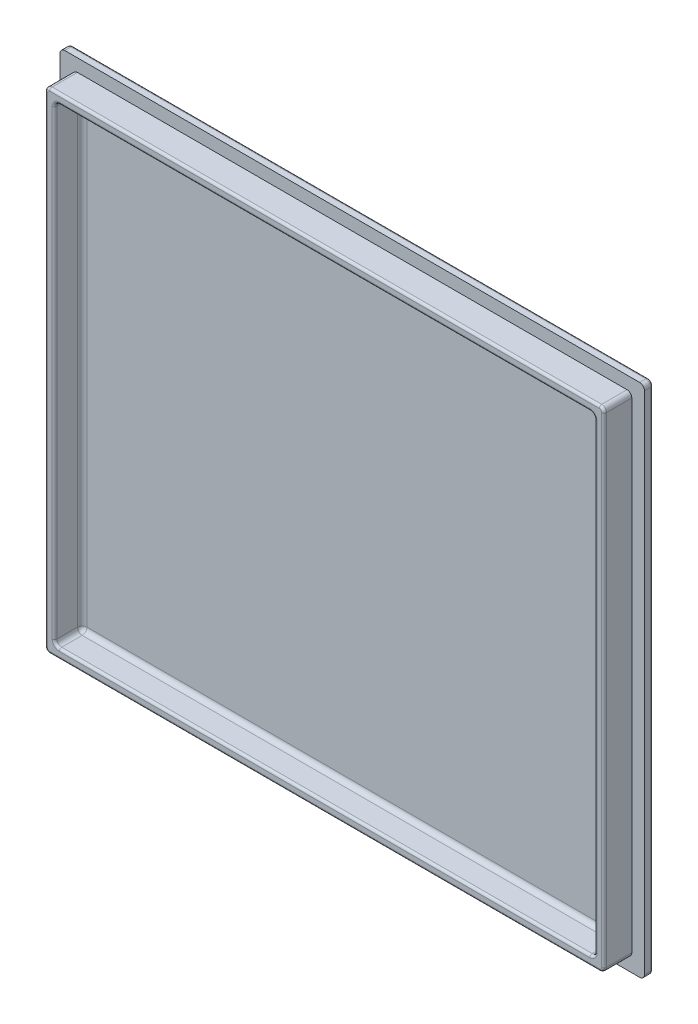
from build123d import *

# Parameters (mm, degrees)
SKETCH1_W           = 122.5
SKETCH1_H           = 108
BOSS_EXTRUDE1_DEPTH = 1.8
SKETCH2_W           = 117.2
SKETCH2_H           = 102.7
SKETCH2_W_2         = 113.2
SKETCH2_H_2         = 98.7
BOSS_EXTRUDE2_DEPTH = 5.8
FILLET1_R           = 1
FILLET2_R           = 0.5
CUT_EXTRUDE1_DEPTH  = 0.4


with BuildPart() as part:
    # Sketch1 → Boss-Extrude1 (new body)
    with BuildSketch(Plane.XY):
        Rectangle(SKETCH1_W, SKETCH1_H)
    extrude(amount=BOSS_EXTRUDE1_DEPTH)

    # Sketch2 → Boss-Extrude2 (add)
    with BuildSketch(Plane.XY.offset(1.8)):
        Rectangle(SKETCH2_W, SKETCH2_H)
        Rectangle(SKETCH2_W_2, SKETCH2_H_2, mode=Mode.SUBTRACT)
    extrude(amount=BOSS_EXTRUDE2_DEPTH)

    # Fillet1
    fillet1_edges = [part.edges().sort_by_distance(p)[0] for p in [
        (-56.6, 0, 1.8),
        (0, -49.35, 1.8),
        (56.6, 0, 1.8),
        (0, 49.35, 1.8),
        (-58.6, 51.35, 4.7),
        (-58.6, -51.35, 4.7),
        (58.6, -51.35, 4.7),
        (58.6, 51.35, 4.7),
        (-56.6, -49.35, 4.7),
        (56.6, -49.35, 4.7),
        (56.6, 49.35, 4.7),
        (-56.6, 49.35, 4.7),
        (61.25, -54, 0.9),
        (-61.25, -54, 0.9),
        (-61.25, 54, 0.9),
        (61.25, 54, 0.9),
    ]]
    fillet(fillet1_edges, radius=FILLET1_R)

    # Fillet2
    fillet2_edges = [part.edges().sort_by_distance(p)[0] for p in [
        (0, 49.35, 7.6),
        (56.6, 0, 7.6),
        (0, -49.35, 7.6),
        (-56.6, 0, 7.6),
        (0, -54, 0),
        (61.25, 0, 0),
        (-61.25, 0, 0),
        (0, 54, 0),
        (60.957106781, 53.707106781, 0),
        (60.957106781, -53.707106781, 0),
        (-60.957106781, 53.707106781, 0),
        (-60.957106781, -53.707106781, 0),
        (-58.6, 0, 7.6),
        (0, 51.35, 7.6),
        (0, -51.35, 7.6),
        (58.6, 0, 7.6),
        (58.307106781, 51.057106781, 7.6),
        (-58.307106781, -51.057106781, 7.6),
        (58.307106781, -51.057106781, 7.6),
        (-58.307106781, 51.057106781, 7.6),
        (56.307106781, -49.057106781, 7.6),
        (56.307106781, 49.057106781, 7.6),
        (-56.307106781, 49.057106781, 7.6),
        (-56.307106781, -49.057106781, 7.6),
    ]]
    fillet(fillet2_edges, radius=FILLET2_R)

    # Sketch3 → Cut-Extrude1 (cut)
    # profile 1 of 21: a face of its own
    with BuildSketch(Plane(origin=(0, 0, 0), x_dir=(-1, 0, 0), z_dir=(0, 0, -1))):
        with BuildLine():
            Line((-30.046875, 15.515625), (-30.046875, 11.715820313))
            add(Edge.make_bspline(
                [(-30.046875, 11.715820313), (-30.047557345, 11.636716191), (-30.048871794, 11.484332417), (-30.05548083, 11.264953882), (-30.069246102, 11.063773405), (-30.085589204, 10.877782305), (-30.112940714, 10.700218671), (-30.15008362, 10.524535589), (-30.203755596, 10.348311449), (-30.247407391, 10.232192122), (-30.26953125, 10.173339844)],
                knots=[0, 0, 0, 0, 1.210006368, 2.330919474, 3.356323987, 4.294191784, 5.185681834, 6.102709867, 7.038404292, 8, 8, 8, 8], degree=3))
            add(Edge.make_bspline(
                [(-30.26953125, 10.173339844), (-30.290338092, 10.12468765), (-30.331593248, 10.028221597), (-30.404876243, 9.890152603), (-30.489008033, 9.760522873), (-30.58269712, 9.639129424), (-30.685611034, 9.525508325), (-30.798838922, 9.421041247), (-30.92272024, 9.326318283), (-31.053992641, 9.237687704), (-31.195720277, 9.160534085), (-31.344841796, 9.090804071), (-31.503614251, 9.034506684), (-31.669918781, 8.987206239), (-31.844716369, 8.950938755), (-32.028101886, 8.92422726), (-32.220000118, 8.910313129), (-32.350566934, 8.907620077), (-32.416992187, 8.90625)],
                knots=[0, 0, 0, 0, 0.953881119, 1.891325734, 2.814479008, 3.737296314, 4.653537642, 5.575724681, 6.510892384, 7.463268797, 8.428782058, 9.417619489, 10.428630225, 11.462688628, 12.533322677, 13.645265432, 14.802039852, 16, 16, 16, 16], degree=3))
            add(Edge.make_bspline(
                [(-32.416992187, 8.90625), (-32.534785854, 8.909094695), (-32.760883214, 8.914554905), (-33.085542348, 8.95497497), (-33.379677086, 9.02433692), (-33.645019511, 9.122444802), (-33.883084533, 9.25358607), (-34.095856644, 9.419289536), (-34.284684073, 9.620731232), (-34.386512586, 9.776154768), (-34.438476562, 9.85546875)],
                knots=[0, 0, 0, 0, 1.20378012, 2.310578459, 3.337050898, 4.286231469, 5.193170284, 6.103603796, 7.032252521, 8, 8, 8, 8], degree=3))
            add(Edge.make_bspline(
                [(-34.438476562, 9.85546875), (-34.463920551, 9.903534711), (-34.515856845, 10.001646994), (-34.584907219, 10.15687609), (-34.64388007, 10.323449667), (-34.698757529, 10.496787548), (-34.739726129, 10.67431652), (-34.770992208, 10.849767363), (-34.791248266, 11.021007189), (-34.793383023, 11.134224253), (-34.794433594, 11.189941406)],
                knots=[0, 0, 0, 0, 0.935734867, 1.910022864, 2.920068211, 3.975205631, 5.037046427, 6.052390226, 7.041529002, 8, 8, 8, 8], degree=3))
            add(Edge.make_bspline(
                [(-34.794433594, 11.189941406), (-34.792578556, 11.244857696), (-34.789052635, 11.349238606), (-34.752122514, 11.495340285), (-34.690985175, 11.620870466), (-34.606374301, 11.725409805), (-34.500743751, 11.805478696), (-34.38202531, 11.865897996), (-34.248394555, 11.899646744), (-34.15545527, 11.904000083), (-34.107421875, 11.90625)],
                knots=[0, 0, 0, 0, 1.173039851, 2.229629267, 3.196748628, 4.139814058, 5.078064495, 6.012468433, 6.97279296, 8, 8, 8, 8], degree=3))
            add(Edge.make_bspline(
                [(-34.107421875, 11.90625), (-34.061803691, 11.904596289), (-33.974658017, 11.90143716), (-33.853138646, 11.869257072), (-33.748850533, 11.815200792), (-33.663143342, 11.737147007), (-33.592022485, 11.63718651), (-33.532740604, 11.514308798), (-33.479973667, 11.369060569), (-33.454449109, 11.262529301), (-33.440917969, 11.206054688)],
                knots=[0, 0, 0, 0, 1.023367024, 1.954966223, 2.799238581, 3.63850462, 4.533990685, 5.539973533, 6.695884835, 8, 8, 8, 8], degree=3))
            add(Edge.make_bspline(
                [(-33.440917969, 11.206054688), (-33.42718378, 11.144914824), (-33.401170396, 11.029112225), (-33.35762025, 10.865893274), (-33.318042144, 10.721076868), (-33.275393042, 10.593159598), (-33.225436737, 10.478674619), (-33.161392429, 10.374670133), (-33.083121465, 10.279116537), (-32.99092666, 10.191407055), (-32.879536275, 10.117675153), (-32.746132689, 10.067099929), (-32.593207248, 10.036235685), (-32.484536325, 10.032971072), (-32.427246094, 10.03125)],
                knots=[0, 0, 0, 0, 1.306183455, 2.473990433, 3.521252936, 4.435448757, 5.282948158, 6.119186039, 6.972897879, 7.851491932, 8.763418147, 9.736895206, 10.806913645, 12, 12, 12, 12], degree=3))
            add(Edge.make_bspline(
                [(-32.427246094, 10.03125), (-32.387659933, 10.032486396), (-32.311072875, 10.034878443), (-32.199531519, 10.050162936), (-32.097086909, 10.080879121), (-31.999980134, 10.11784165), (-31.912251174, 10.169828268), (-31.831846007, 10.232622181), (-31.758039178, 10.305673821), (-31.694090089, 10.391895351), (-31.635889144, 10.487495745), (-31.588594918, 10.595995186), (-31.54544516, 10.714023437), (-31.512912526, 10.844393413), (-31.484312932, 10.984948151), (-31.465874477, 11.137268742), (-31.456223585, 11.300653907), (-31.454180977, 11.413073354), (-31.453125, 11.471191406)],
                knots=[0, 0, 0, 0, 0.963361052, 1.863807676, 2.728602533, 3.560208343, 4.385341088, 5.19798089, 6.037943909, 6.902738766, 7.80318539, 8.754830499, 9.776827693, 10.857282673, 12.019774497, 13.264791246, 14.58596523, 16, 16, 16, 16], degree=3))
            Line((-31.453125, 11.471191406), (-31.453125, 15.509765625))
            add(Edge.make_bspline(
                [(-31.453125, 15.509765625), (-31.451198678, 15.579771909), (-31.447560429, 15.711992941), (-31.412453824, 15.896207675), (-31.356822294, 16.054710678), (-31.273227148, 16.183627886), (-31.168830369, 16.283627792), (-31.047011623, 16.356608249), (-30.906873086, 16.397876859), (-30.808371867, 16.403391876), (-30.757324219, 16.40625)],
                knots=[0, 0, 0, 0, 1.305302689, 2.465328236, 3.486148504, 4.421450945, 5.30454368, 6.162639947, 7.047799498, 8, 8, 8, 8], degree=3))
            add(Edge.make_bspline(
                [(-30.757324219, 16.40625), (-30.705198234, 16.404281792), (-30.604870923, 16.400493565), (-30.463804311, 16.35541414), (-30.338264323, 16.286101068), (-30.233223174, 16.185172275), (-30.147389594, 16.05737771), (-30.089109154, 15.900439469), (-30.051844022, 15.717070978), (-30.04860254, 15.585660121), (-30.046875, 15.515625)],
                knots=[0, 0, 0, 0, 0.965391849, 1.858097617, 2.723685037, 3.609584463, 4.538324685, 5.561246394, 6.700271746, 8, 8, 8, 8], degree=3))
        make_face()
    # profile 2 of 21: a face of its own
    with BuildSketch(Plane(origin=(0, 0, 0), x_dir=(-1, 0, 0), z_dir=(0, 0, -1))):
        with BuildLine():
            add(Edge.make_bspline(
                [(-25.196777344, 16.40625), (-25.103953521, 16.404946936), (-24.921943649, 16.402391876), (-24.654042029, 16.379230949), (-24.395663714, 16.344853051), (-24.14698363, 16.295369892), (-23.908618689, 16.23080155), (-23.680523501, 16.151445937), (-23.462404142, 16.057565898), (-23.254005513, 15.951003325), (-23.057616886, 15.830374847), (-22.871987867, 15.698461366), (-22.699221039, 15.553327636), (-22.538913675, 15.396247639), (-22.392088564, 15.226792777), (-22.256611177, 15.045903933), (-22.133525117, 14.852563577), (-22.024156057, 14.64681279), (-21.925895348, 14.431725901), (-21.840598478, 14.206672522), (-21.76940633, 13.972606101), (-21.710189819, 13.729138911), (-21.665309693, 13.476627294), (-21.633696839, 13.214479864), (-21.611811164, 12.943730614), (-21.610194942, 12.759810325), (-21.609375, 12.666503906)],
                knots=[0, 0, 0, 0, 1.137132438, 2.22970057, 3.292424762, 4.329649132, 5.333981859, 6.315987487, 7.286185149, 8.241436353, 9.181332131, 10.107725602, 11.0292572, 11.943085262, 12.854854597, 13.773819033, 14.709898734, 15.660115542, 16.626635295, 17.605574315, 18.606712189, 19.622473761, 20.67399022, 21.747038223, 22.857027702, 24, 24, 24, 24], degree=3))
            add(Edge.make_bspline(
                [(-21.609375, 12.666503906), (-21.612236463, 12.529681291), (-21.617850987, 12.261219335), (-21.660438971, 11.868195898), (-21.732633965, 11.494071676), (-21.830958179, 11.138998428), (-21.960192421, 10.805434355), (-22.117419853, 10.493817511), (-22.304187292, 10.205652032), (-22.518482598, 9.94119842), (-22.759486365, 9.7019547), (-23.028845105, 9.493389262), (-23.324888454, 9.315378239), (-23.644986712, 9.165436009), (-23.991057114, 9.047298892), (-24.362398942, 8.967874715), (-24.756718598, 8.913817681), (-25.028127226, 8.908817378), (-25.167480469, 8.90625)],
                knots=[0, 0, 0, 0, 1.119700056, 2.196982321, 3.230778928, 4.235358115, 5.208318876, 6.153781848, 7.087131445, 8.013361148, 8.934611457, 9.860297843, 10.794468433, 11.756326826, 12.748403726, 13.780058436, 14.860183413, 16, 16, 16, 16], degree=3))
            add(Edge.make_bspline(
                [(-25.167480469, 8.90625), (-25.305829686, 8.90958087), (-25.576673384, 8.916101654), (-25.971499241, 8.968354297), (-26.34481766, 9.052410131), (-26.69449719, 9.172594274), (-27.018095269, 9.325643475), (-27.316968746, 9.503792079), (-27.585319121, 9.714243232), (-27.826593308, 9.950989751), (-28.04077208, 10.214405028), (-28.222857641, 10.505794659), (-28.38344225, 10.818816651), (-28.510373607, 11.158114006), (-28.611361061, 11.516325766), (-28.68253515, 11.890781818), (-28.725931166, 12.279247212), (-28.73153067, 12.542855196), (-28.734375, 12.676757813)],
                knots=[0, 0, 0, 0, 1.130091603, 2.212359386, 3.247930852, 4.252250901, 5.226719473, 6.16821431, 7.089197795, 8.00610207, 8.925165125, 9.855999165, 10.808795857, 11.79501972, 12.810514548, 13.846493258, 14.906102224, 16, 16, 16, 16], degree=3))
            add(Edge.make_bspline(
                [(-28.734375, 12.676757813), (-28.731794897, 12.813123311), (-28.726721491, 13.081266672), (-28.679880961, 13.474123592), (-28.605926211, 13.850241465), (-28.500515847, 14.207726794), (-28.36686457, 14.544068229), (-28.20464001, 14.855597765), (-28.016818058, 15.141349776), (-27.80215582, 15.400780424), (-27.560312411, 15.632310235), (-27.292640828, 15.834794061), (-27.000458652, 16.008973051), (-26.683752456, 16.152238026), (-26.343963136, 16.267227072), (-25.981179063, 16.348412804), (-25.596082294, 16.397596314), (-25.332181227, 16.403315544), (-25.196777344, 16.40625)],
                knots=[0, 0, 0, 0, 1.125218611, 2.212582392, 3.260701818, 4.286054269, 5.284468473, 6.243521648, 7.180287843, 8.101949555, 9.017004541, 9.937572836, 10.866572707, 11.818894766, 12.801573564, 13.82236102, 14.882684417, 16, 16, 16, 16], degree=3))
        make_face()
        with BuildLine():
            add(Edge.make_bspline(
                [(-23.109375, 12.676757813), (-23.112239567, 12.807290522), (-23.117786032, 13.060032098), (-23.166943085, 13.425641394), (-23.246562329, 13.764762036), (-23.341458535, 14.027343783), (-23.432582367, 14.221981754), (-23.507003023, 14.357450361), (-23.587057743, 14.484987604), (-23.677918083, 14.600344408), (-23.772168099, 14.709023688), (-23.874210567, 14.808462676), (-23.984223246, 14.897180755), (-24.13838782, 15.00486256), (-24.34599589, 15.11643983), (-24.614050789, 15.21204985), (-24.899787334, 15.270968536), (-25.096394289, 15.27777485), (-25.196777344, 15.28125)],
                knots=[0, 0, 0, 0, 1.663767962, 3.22144036, 4.693807908, 6.09809827, 6.772124886, 7.43249818, 8.068074837, 8.689496673, 9.30272399, 9.901527182, 10.503429657, 11.102750509, 12.297797107, 13.495176895, 14.721094103, 16, 16, 16, 16], degree=3))
            add(Edge.make_bspline(
                [(-25.196777344, 15.28125), (-25.268683164, 15.279461327), (-25.410798157, 15.275926186), (-25.61941784, 15.242353303), (-25.819816768, 15.189848909), (-26.011062575, 15.116413025), (-26.19145206, 15.022631636), (-26.360178234, 14.908774737), (-26.515206508, 14.775285571), (-26.657404638, 14.622704684), (-26.785922851, 14.449494607), (-26.899942435, 14.253858622), (-26.99928744, 14.035794097), (-27.083982869, 13.797246773), (-27.150968666, 13.539443302), (-27.198598961, 13.265086624), (-27.228520242, 12.97575706), (-27.232394389, 12.77790652), (-27.234375, 12.676757813)],
                knots=[0, 0, 0, 0, 0.926902171, 1.831933723, 2.71800685, 3.595261319, 4.468550136, 5.334998465, 6.214894287, 7.1017058, 8.020008637, 8.99111482, 10.01694856, 11.106630737, 12.25237115, 13.448355624, 14.695502513, 16, 16, 16, 16], degree=3))
            add(Edge.make_bspline(
                [(-27.234375, 12.676757813), (-27.232388921, 12.574634374), (-27.22850333, 12.374838703), (-27.198643118, 12.082573109), (-27.150701899, 11.804885811), (-27.084194453, 11.542926095), (-26.998152674, 11.299747953), (-26.89486427, 11.077579628), (-26.779073356, 10.874836419), (-26.642473979, 10.697171482), (-26.494923833, 10.540390834), (-26.336350989, 10.403835916), (-26.167899684, 10.287505513), (-25.987956828, 10.192801372), (-25.7975089, 10.121743717), (-25.598661191, 10.067891189), (-25.390122793, 10.037132148), (-25.248143622, 10.033226935), (-25.176269531, 10.03125)],
                knots=[0, 0, 0, 0, 1.300369924, 2.54406124, 3.737115199, 4.88637188, 5.981883645, 7.016846829, 8.003376514, 8.948590554, 9.863559023, 10.741055788, 11.608647785, 12.46534091, 13.323432129, 14.192248925, 15.0848625, 16, 16, 16, 16], degree=3))
            add(Edge.make_bspline(
                [(-25.176269531, 10.03125), (-25.083697318, 10.034350516), (-24.901298636, 10.040459585), (-24.634218732, 10.097499603), (-24.379042185, 10.187181804), (-24.176997685, 10.290442989), (-24.024721749, 10.392161634), (-23.914681757, 10.477977168), (-23.812383256, 10.575631145), (-23.714874132, 10.681353913), (-23.624519148, 10.797450754), (-23.538971461, 10.922449348), (-23.459987404, 11.057686013), (-23.386913423, 11.20240464), (-23.32092258, 11.35634196), (-23.263363298, 11.519089161), (-23.217478217, 11.691361703), (-23.177430966, 11.87155969), (-23.146965096, 12.060868402), (-23.125300865, 12.25838107), (-23.111726827, 12.464653338), (-23.11017111, 12.604958952), (-23.109375, 12.676757813)],
                knots=[0, 0, 0, 0, 1.468568495, 2.893578421, 4.316075305, 5.755382189, 6.482330971, 7.222315454, 7.968369796, 8.725783183, 9.504530818, 10.302500265, 11.129737207, 11.9897977, 12.875655565, 13.787998707, 14.728608307, 15.705132475, 16.718642732, 17.771954593, 18.859838044, 20, 20, 20, 20], degree=3))
        make_face(mode=Mode.SUBTRACT)
    # profile 3 of 21: a face of its own
    with BuildSketch(Plane(origin=(0, 0, 0), x_dir=(-1, 0, 0), z_dir=(0, 0, -1))):
        with BuildLine():
            Line((-20.296875, 12.027832031), (-20.296875, 15.515625))
            add(Edge.make_bspline(
                [(-20.296875, 15.515625), (-20.295146872, 15.585659194), (-20.291904287, 15.717068313), (-20.254646403, 15.900448225), (-20.196342562, 16.057349593), (-20.110585709, 16.185265064), (-20.005897158, 16.285184075), (-19.883477802, 16.355161602), (-19.74723779, 16.400231352), (-19.650757558, 16.404204165), (-19.601074219, 16.40625)],
                knots=[0, 0, 0, 0, 1.314006093, 2.465543923, 3.499702682, 4.438645347, 5.334276599, 6.193453487, 7.069703068, 8, 8, 8, 8], degree=3))
            add(Edge.make_bspline(
                [(-19.601074219, 16.40625), (-19.549034135, 16.403455419), (-19.449054319, 16.398086448), (-19.306801493, 16.356239043), (-19.182532819, 16.284192332), (-19.076378706, 16.183727671), (-18.991638804, 16.054577579), (-18.932287764, 15.896710235), (-18.895926176, 15.712094468), (-18.892459288, 15.579774509), (-18.890625, 15.509765625)],
                knots=[0, 0, 0, 0, 0.96282878, 1.849794185, 2.716851436, 3.599658085, 4.532680285, 5.552030856, 6.704809248, 8, 8, 8, 8], degree=3))
            Line((-18.890625, 15.509765625), (-18.890625, 11.919433594))
            add(Edge.make_bspline(
                [(-18.890625, 11.919433594), (-18.88896099, 11.821235593), (-18.885776139, 11.633288482), (-18.861153533, 11.363416244), (-18.819555534, 11.1187183), (-18.760828211, 10.897681447), (-18.678607307, 10.700229845), (-18.569297614, 10.526335706), (-18.432260767, 10.376345914), (-18.297208954, 10.271477757), (-18.175605283, 10.202089325), (-18.074446639, 10.156508461), (-17.96508357, 10.116486396), (-17.845931107, 10.087122695), (-17.719499161, 10.061336401), (-17.583817451, 10.044800712), (-17.439696126, 10.031996788), (-17.340363977, 10.031502733), (-17.289550781, 10.03125)],
                knots=[0, 0, 0, 0, 1.640841622, 3.140506311, 4.523579023, 5.784571649, 6.954579444, 8.084197464, 9.198982671, 10.333306227, 10.925380769, 11.535182691, 12.185613052, 12.868404783, 13.583722754, 14.340779317, 15.151228418, 16, 16, 16, 16], degree=3))
            add(Edge.make_bspline(
                [(-17.289550781, 10.03125), (-17.219652438, 10.032488531), (-17.084856951, 10.034876977), (-16.890998029, 10.057752844), (-16.712341472, 10.09118436), (-16.55058932, 10.143143292), (-16.403631665, 10.207455987), (-16.27278386, 10.286362126), (-16.157477736, 10.380206623), (-16.058606607, 10.489666249), (-15.975165921, 10.615094367), (-15.901342478, 10.753195607), (-15.840494884, 10.90684669), (-15.789005599, 11.074238926), (-15.749767614, 11.257064412), (-15.72257464, 11.454387413), (-15.706561042, 11.666727531), (-15.704297139, 11.812959872), (-15.703125, 11.888671875)],
                knots=[0, 0, 0, 0, 1.187087794, 2.289239917, 3.312641325, 4.270309596, 5.169103343, 6.032749862, 6.858132282, 7.686303516, 8.528484611, 9.411791075, 10.342302716, 11.33164497, 12.384483705, 13.515514569, 14.713654137, 16, 16, 16, 16], degree=3))
            Line((-15.703125, 11.888671875), (-15.703125, 15.509765625))
            add(Edge.make_bspline(
                [(-15.703125, 15.509765625), (-15.701152924, 15.58071911), (-15.697452358, 15.713862034), (-15.663337742, 15.899799065), (-15.603711168, 16.056902331), (-15.519877824, 16.185081109), (-15.416203048, 16.286081405), (-15.292874569, 16.354713587), (-15.155530557, 16.400621444), (-15.058014651, 16.404324887), (-15.007324219, 16.40625)],
                knots=[0, 0, 0, 0, 1.324209478, 2.484855026, 3.512713035, 4.440887327, 5.324452051, 6.186293477, 7.057204391, 8, 8, 8, 8], degree=3))
            add(Edge.make_bspline(
                [(-15.007324219, 16.40625), (-14.956671237, 16.404202394), (-14.858292888, 16.400225529), (-14.719194495, 16.355185457), (-14.594438226, 16.285696562), (-14.487288029, 16.186407102), (-14.398792471, 16.059395029), (-14.338347826, 15.901296805), (-14.302150757, 15.716002986), (-14.298704393, 15.583193193), (-14.296875, 15.512695313)],
                knots=[0, 0, 0, 0, 0.937671153, 1.821147261, 2.686184232, 3.571984669, 4.510357278, 5.535961965, 6.692043289, 8, 8, 8, 8], degree=3))
            Line((-14.296875, 15.512695313), (-14.296875, 12.01171875))
            add(Edge.make_bspline(
                [(-14.296875, 12.01171875), (-14.298847418, 11.875440511), (-14.302634598, 11.613776875), (-14.331025919, 11.238859506), (-14.380669028, 10.899209785), (-14.447767244, 10.590603142), (-14.545113897, 10.307585952), (-14.678978125, 10.045710465), (-14.8472184, 9.800451933), (-14.984745128, 9.655972949), (-15.054199219, 9.583007812)],
                knots=[0, 0, 0, 0, 1.248457049, 2.397123805, 3.441600438, 4.391152342, 5.286682789, 6.174943873, 7.078305605, 8, 8, 8, 8], degree=3))
            add(Edge.make_bspline(
                [(-15.054199219, 9.583007812), (-15.120850225, 9.526699466), (-15.253996226, 9.414214574), (-15.4758685, 9.2744411), (-15.711986229, 9.155694832), (-15.965597237, 9.06195424), (-16.238167591, 8.991788363), (-16.53129762, 8.943057854), (-16.845996679, 8.911603727), (-17.063397501, 8.908069206), (-17.175292969, 8.90625)],
                knots=[0, 0, 0, 0, 0.917673777, 1.83319953, 2.752815171, 3.696261941, 4.673826777, 5.7116717, 6.822205161, 8, 8, 8, 8], degree=3))
            add(Edge.make_bspline(
                [(-17.175292969, 8.90625), (-17.308186532, 8.908418141), (-17.564660384, 8.91260248), (-17.93511442, 8.946819482), (-18.27736461, 9.000763176), (-18.59120097, 9.079938307), (-18.878262837, 9.181043198), (-19.135648971, 9.311731691), (-19.369128309, 9.462019208), (-19.572900799, 9.641592073), (-19.750514215, 9.846119646), (-19.903066164, 10.076717487), (-20.026178722, 10.335476681), (-20.128810633, 10.619242222), (-20.202434746, 10.93170181), (-20.258734422, 11.271218718), (-20.289861091, 11.640049288), (-20.294480639, 11.895453394), (-20.296875, 12.027832031)],
                knots=[0, 0, 0, 0, 1.244583114, 2.401944964, 3.48169555, 4.486712429, 5.430003149, 6.325898902, 7.184706889, 8.024138875, 8.860562605, 9.715550095, 10.605366032, 11.538500779, 12.536866304, 13.60758979, 14.759988597, 16, 16, 16, 16], degree=3))
        make_face()
    # profile 4 of 21: a face of its own
    with BuildSketch(Plane(origin=(0, 0, 0), x_dir=(-1, 0, 0), z_dir=(0, 0, -1))):
        with BuildLine():
            Line((-11.296875, 15.512695313), (-11.296875, 10.21875))
            Line((-11.296875, 10.21875), (-8.3203125, 10.21875))
            add(Edge.make_bspline(
                [(-8.3203125, 10.21875), (-8.264431535, 10.2172871), (-8.157869972, 10.21449744), (-8.008886269, 10.180012338), (-7.878365392, 10.126654826), (-7.772834862, 10.047307781), (-7.687774219, 9.954500459), (-7.6259966, 9.848349045), (-7.589861841, 9.729833876), (-7.585649643, 9.647218716), (-7.583496094, 9.604980469)],
                knots=[0, 0, 0, 0, 1.240270116, 2.365118784, 3.381765818, 4.352609133, 5.275186246, 6.165500839, 7.062084633, 8, 8, 8, 8], degree=3))
            add(Edge.make_bspline(
                [(-7.583496094, 9.604980469), (-7.585561979, 9.561752756), (-7.589558199, 9.478133635), (-7.626039798, 9.358706914), (-7.687084611, 9.253351492), (-7.771067036, 9.162506629), (-7.87646589, 9.087417874), (-8.006390887, 9.037559482), (-8.156046934, 9.004345058), (-8.263463127, 9.001503747), (-8.3203125, 9)],
                knots=[0, 0, 0, 0, 0.961785517, 1.860465312, 2.752861249, 3.654173772, 4.599371787, 5.609990076, 6.735101654, 8, 8, 8, 8], degree=3))
            Line((-8.3203125, 9), (-11.841796875, 9))
            add(Edge.make_bspline(
                [(-11.841796875, 9), (-11.913358444, 9.001872359), (-12.046633409, 9.005359406), (-12.230453231, 9.047257735), (-12.384993007, 9.111499373), (-12.508127522, 9.209140298), (-12.598882716, 9.339200098), (-12.660985106, 9.499737551), (-12.69609223, 9.691860425), (-12.700673411, 9.829924512), (-12.703125, 9.903808594)],
                knots=[0, 0, 0, 0, 1.184943227, 2.206816713, 3.109923682, 3.939837529, 4.776053014, 5.71019795, 6.774627611, 8, 8, 8, 8], degree=3))
            Line((-12.703125, 9.903808594), (-12.703125, 15.512695313))
            add(Edge.make_bspline(
                [(-12.703125, 15.512695313), (-12.701313102, 15.582702669), (-12.697900936, 15.714540511), (-12.661556645, 15.898264986), (-12.601718154, 16.054882387), (-12.517464455, 16.183837463), (-12.411607777, 16.283266003), (-12.290494557, 16.355976546), (-12.153046921, 16.397838828), (-12.056921996, 16.403387197), (-12.007324219, 16.40625)],
                knots=[0, 0, 0, 0, 1.312227502, 2.471186598, 3.495416453, 4.440711492, 5.33513045, 6.197779038, 7.0701043, 8, 8, 8, 8], degree=3))
            add(Edge.make_bspline(
                [(-12.007324219, 16.40625), (-11.956671214, 16.404202398), (-11.858292822, 16.400225541), (-11.71919474, 16.355185411), (-11.594437315, 16.285696733), (-11.487291612, 16.18640643), (-11.39877766, 16.059397807), (-11.338584055, 15.901735353), (-11.301906674, 15.716533127), (-11.298627552, 15.583692843), (-11.296875, 15.512695313)],
                knots=[0, 0, 0, 0, 0.937651975, 1.821110013, 2.686129292, 3.571911612, 4.510265029, 5.535848738, 6.683015045, 8, 8, 8, 8], degree=3))
        make_face()
    # profile 5 of 21: a face of its own
    with BuildSketch(Plane(origin=(0, 0, 0), x_dir=(-1, 0, 0), z_dir=(0, 0, -1))):
        with BuildLine():
            Line((-1.801757813, 15.09375), (-5.109375, 15.09375))
            Line((-5.109375, 15.09375), (-5.109375, 13.3125))
            Line((-5.109375, 13.3125), (-2.063964844, 13.3125))
            add(Edge.make_bspline(
                [(-2.063964844, 13.3125), (-2.011117234, 13.310499943), (-1.911919206, 13.306745721), (-1.773060758, 13.28019061), (-1.655625248, 13.231450001), (-1.560086538, 13.163434108), (-1.486712377, 13.07883871), (-1.432775125, 12.982400204), (-1.401242348, 12.872030031), (-1.397790918, 12.794639441), (-1.395996094, 12.754394531)],
                knots=[0, 0, 0, 0, 1.285293232, 2.412569968, 3.418386025, 4.354403319, 5.23810445, 6.120527863, 7.022630715, 8, 8, 8, 8], degree=3))
            add(Edge.make_bspline(
                [(-1.395996094, 12.754394531), (-1.397740492, 12.714124963), (-1.401094955, 12.636686953), (-1.433363054, 12.526458578), (-1.485309265, 12.427993789), (-1.557981242, 12.341619138), (-1.652728898, 12.271095052), (-1.770462135, 12.221139358), (-1.91029866, 12.192864126), (-2.010606243, 12.189362623), (-2.063964844, 12.1875)],
                knots=[0, 0, 0, 0, 0.971200242, 1.867609123, 2.749214551, 3.645234956, 4.57279535, 5.576919765, 6.711042891, 8, 8, 8, 8], degree=3))
            Line((-2.063964844, 12.1875), (-5.109375, 12.1875))
            Line((-5.109375, 12.1875), (-5.109375, 10.125))
            Line((-5.109375, 10.125), (-1.6875, 10.125))
            add(Edge.make_bspline(
                [(-1.6875, 10.125), (-1.63319901, 10.122968169), (-1.531118955, 10.119148545), (-1.387236267, 10.092772064), (-1.265305119, 10.042668469), (-1.164619379, 9.974077008), (-1.085050695, 9.889889618), (-1.030320035, 9.789782074), (-0.994768837, 9.678161067), (-0.991775762, 9.598915633), (-0.990234375, 9.558105469)],
                knots=[0, 0, 0, 0, 1.281412047, 2.408917619, 3.431661904, 4.368016538, 5.264760761, 6.136510243, 7.040331808, 8, 8, 8, 8], degree=3))
            add(Edge.make_bspline(
                [(-0.990234375, 9.558105469), (-0.991695332, 9.518240316), (-0.994514505, 9.441313508), (-1.030961541, 9.332899099), (-1.085446328, 9.234851522), (-1.164635373, 9.151028698), (-1.264965997, 9.081915175), (-1.38780435, 9.034572721), (-1.530847587, 9.005149913), (-1.633138565, 9.00178712), (-1.6875, 9)],
                knots=[0, 0, 0, 0, 0.944744106, 1.823049547, 2.692159438, 3.596595969, 4.540982691, 5.5681055, 6.707595947, 8, 8, 8, 8], degree=3))
            Line((-1.6875, 9), (-5.654296875, 9))
            add(Edge.make_bspline(
                [(-5.654296875, 9), (-5.725804653, 9.002080975), (-5.858872775, 9.00595344), (-6.043237929, 9.045290679), (-6.196909912, 9.110355932), (-6.321118482, 9.206076585), (-6.410913531, 9.336057185), (-6.473605385, 9.495218651), (-6.508568697, 9.686014754), (-6.513164554, 9.823096217), (-6.515625, 9.896484375)],
                knots=[0, 0, 0, 0, 1.189456171, 2.21344733, 3.119993849, 3.948013107, 4.78741338, 5.71757596, 6.778077714, 8, 8, 8, 8], degree=3))
            Line((-6.515625, 9.896484375), (-6.515625, 15.322265625))
            add(Edge.make_bspline(
                [(-6.515625, 15.322265625), (-6.514498817, 15.372605022), (-6.512360321, 15.46819391), (-6.496454894, 15.604644771), (-6.469392192, 15.726808639), (-6.429578673, 15.835249068), (-6.378749492, 15.93069899), (-6.312831114, 16.011481764), (-6.234050694, 16.077882297), (-6.143064409, 16.131754914), (-6.038548521, 16.170273646), (-5.92238, 16.200242008), (-5.792375128, 16.215198207), (-5.701689441, 16.217530919), (-5.654296875, 16.21875)],
                knots=[0, 0, 0, 0, 1.257097402, 2.387087425, 3.425508426, 4.374733264, 5.264346199, 6.113849079, 6.961774747, 7.825601221, 8.740599092, 9.73444991, 10.816017894, 12, 12, 12, 12], degree=3))
            Line((-5.654296875, 16.21875), (-1.801757813, 16.21875))
            add(Edge.make_bspline(
                [(-1.801757813, 16.21875), (-1.746987064, 16.216675053), (-1.643973643, 16.212772469), (-1.499335979, 16.187060865), (-1.378191279, 16.136257484), (-1.278484892, 16.068399777), (-1.20349846, 15.982992088), (-1.146534527, 15.886703102), (-1.114158188, 15.776432588), (-1.110673924, 15.698932363), (-1.108886719, 15.659179688)],
                knots=[0, 0, 0, 0, 1.304353081, 2.453241492, 3.474309848, 4.409392115, 5.298405909, 6.157667996, 7.055001114, 8, 8, 8, 8], degree=3))
            add(Edge.make_bspline(
                [(-1.108886719, 15.659179688), (-1.110604123, 15.618429598), (-1.113933066, 15.539441392), (-1.146973229, 15.427123703), (-1.202528613, 15.328430167), (-1.278639472, 15.242803261), (-1.377827533, 15.174443463), (-1.499743128, 15.125921841), (-1.643906037, 15.099570674), (-1.746963596, 15.095770499), (-1.801757813, 15.09375)],
                knots=[0, 0, 0, 0, 0.962139494, 1.864969442, 2.738963821, 3.622448103, 4.551714319, 5.562017248, 6.70375977, 8, 8, 8, 8], degree=3))
        make_face()
    # profile 6 of 21: a face of its own
    with BuildSketch(Plane(origin=(0, 0, 0), x_dir=(-1, 0, 0), z_dir=(0, 0, -1))):
        with BuildLine():
            Line((2.620605469, 10.117675781), (1.453125, 14.71875))
            Line((1.453125, 14.71875), (1.453125, 9.733886719))
            add(Edge.make_bspline(
                [(1.453125, 9.733886719), (1.451163245, 9.668749835), (1.447489199, 9.54675912), (1.413188001, 9.376307142), (1.359724399, 9.229820408), (1.278169338, 9.111056582), (1.179056204, 9.019120919), (1.064297993, 8.952094058), (0.933569679, 8.913493944), (0.84156456, 8.908720566), (0.793945312, 8.90625)],
                knots=[0, 0, 0, 0, 1.30362474, 2.441475632, 3.469867302, 4.406120522, 5.299256138, 6.158467928, 7.046875082, 8, 8, 8, 8], degree=3))
            add(Edge.make_bspline(
                [(0.793945312, 8.90625), (0.747757565, 8.908691748), (0.658092932, 8.913431931), (0.53054656, 8.953024995), (0.416284895, 9.01744071), (0.3164592, 9.108150803), (0.236686715, 9.22661659), (0.179180559, 9.371198343), (0.14672024, 9.542034987), (0.14274126, 9.664407277), (0.140625, 9.729492188)],
                knots=[0, 0, 0, 0, 0.931401934, 1.808137819, 2.66942439, 3.563139973, 4.50699297, 5.529036112, 6.685793447, 8, 8, 8, 8], degree=3))
            Line((0.140625, 9.729492188), (0.140625, 15.418945313))
            add(Edge.make_bspline(
                [(0.140625, 15.418945313), (0.141693797, 15.456558044), (0.143752136, 15.528994375), (0.153062178, 15.633065928), (0.172013883, 15.727933602), (0.199571614, 15.812328663), (0.234034786, 15.887490257), (0.274334833, 15.954215578), (0.324765517, 16.010520765), (0.403666005, 16.072024018), (0.518850908, 16.131811318), (0.675139918, 16.183106114), (0.852346815, 16.213569174), (0.977415483, 16.216968358), (1.04296875, 16.21875)],
                knots=[0, 0, 0, 0, 0.969665939, 1.867427353, 2.689218696, 3.457225703, 4.149776576, 4.816702983, 5.458338976, 6.085245707, 7.385799533, 8.77853966, 10.311509556, 12, 12, 12, 12], degree=3))
            Line((1.04296875, 16.21875), (1.492675781, 16.21875))
            add(Edge.make_bspline(
                [(1.492675781, 16.21875), (1.555677503, 16.217971496), (1.672566568, 16.216527112), (1.83389565, 16.204737268), (1.96732963, 16.181599944), (2.076809289, 16.150567842), (2.166381792, 16.104119941), (2.242333431, 16.045333315), (2.304916433, 15.969966516), (2.3557128, 15.877376607), (2.401037923, 15.763023607), (2.448342329, 15.622257402), (2.501671384, 15.45270676), (2.534255783, 15.328774602), (2.551757812, 15.262207031)],
                knots=[0, 0, 0, 0, 1.38803647, 2.575267475, 3.558583177, 4.368440808, 5.070869684, 5.768090105, 6.470518981, 7.212366556, 8.085347214, 9.177334938, 10.483864409, 12, 12, 12, 12], degree=3))
            Line((2.551757812, 15.262207031), (3.609375, 11.34375))
            Line((3.609375, 11.34375), (4.653808594, 15.262207031))
            add(Edge.make_bspline(
                [(4.653808594, 15.262207031), (4.671317323, 15.328770732), (4.703914195, 15.452695686), (4.75716393, 15.622292141), (4.804698511, 15.762925406), (4.849475473, 15.877873383), (4.902339556, 15.969556591), (4.964597525, 16.045395996), (5.040682503, 16.104082726), (5.130604019, 16.150877797), (5.241225087, 16.181498062), (5.376063462, 16.204749313), (5.538377211, 16.216479717), (5.655749899, 16.217957042), (5.71875, 16.21875)],
                knots=[0, 0, 0, 0, 1.511478991, 2.813995637, 3.902629473, 4.772928891, 5.517843496, 6.218114959, 6.913193965, 7.613465427, 8.431097637, 9.421953472, 10.616226692, 12, 12, 12, 12], degree=3))
            Line((5.71875, 16.21875), (6.169921875, 16.21875))
            add(Edge.make_bspline(
                [(6.169921875, 16.21875), (6.235956364, 16.216950866), (6.361981491, 16.213517264), (6.54025294, 16.183333312), (6.69689661, 16.131736577), (6.812346217, 16.072190372), (6.890990536, 16.010039501), (6.943209495, 15.954821325), (6.982720004, 15.886998806), (7.020108526, 15.813074532), (7.044181057, 15.727349105), (7.066445378, 15.633358422), (7.07478089, 15.528940032), (7.076982045, 15.45653947), (7.078125, 15.418945313)],
                knots=[0, 0, 0, 0, 1.69575107, 3.236297379, 4.624693315, 5.921190494, 6.546141798, 7.194208304, 7.859054455, 8.55478081, 9.316580419, 10.138397467, 11.033358612, 12, 12, 12, 12], degree=3))
            Line((7.078125, 15.418945313), (7.078125, 9.729492188))
            add(Edge.make_bspline(
                [(7.078125, 9.729492188), (7.076107366, 9.664858098), (7.072315375, 9.543383206), (7.03853212, 9.373712308), (6.984250429, 9.228107989), (6.903657988, 9.109583151), (6.803315588, 9.018746296), (6.687781664, 8.952068927), (6.555608252, 8.913503207), (6.462653721, 8.908723464), (6.414550781, 8.90625)],
                knots=[0, 0, 0, 0, 1.293518314, 2.431070022, 3.450077594, 4.386084638, 5.272371044, 6.139835868, 7.037385671, 8, 8, 8, 8], degree=3))
            add(Edge.make_bspline(
                [(6.414550781, 8.90625), (6.368866709, 8.908724674), (6.280189056, 8.913528281), (6.153576632, 8.952740898), (6.040971474, 9.019548319), (5.941913604, 9.110978892), (5.860821246, 9.230147755), (5.805085669, 9.37592739), (5.77141664, 9.546821252), (5.767641001, 9.668771463), (5.765625, 9.733886719)],
                knots=[0, 0, 0, 0, 0.922456205, 1.790585791, 2.649061979, 3.550299627, 4.495046019, 5.536376652, 6.684549498, 8, 8, 8, 8], degree=3))
            Line((5.765625, 9.733886719), (5.765625, 14.71875))
            Line((5.765625, 14.71875), (4.598144531, 10.117675781))
            add(Edge.make_bspline(
                [(4.598144531, 10.117675781), (4.580370765, 10.047775507), (4.547357379, 9.917941188), (4.497347939, 9.738885251), (4.452955389, 9.589626032), (4.415884391, 9.463760192), (4.370016012, 9.355500603), (4.311276125, 9.256212492), (4.234237503, 9.164124221), (4.147418805, 9.074142727), (4.040485957, 8.997614758), (3.913257449, 8.943411191), (3.767236728, 8.910972097), (3.663752659, 8.907876592), (3.609375, 8.90625)],
                knots=[0, 0, 0, 0, 1.501096557, 2.788170037, 3.868651286, 4.742863802, 5.516817816, 6.309819568, 7.133547599, 8.010237478, 8.906902995, 9.849006967, 10.869720086, 12, 12, 12, 12], degree=3))
            add(Edge.make_bspline(
                [(3.609375, 8.90625), (3.567776148, 8.907648329), (3.487461146, 8.910348087), (3.372227979, 8.931233613), (3.266244848, 8.964636329), (3.17086198, 9.013509138), (3.086090943, 9.073430603), (3.012224925, 9.14262275), (2.945330855, 9.216229389), (2.873214575, 9.328753833), (2.79971396, 9.483388771), (2.734581194, 9.685116273), (2.680839922, 9.899229464), (2.640915015, 10.044021164), (2.620605469, 10.117675781)],
                knots=[0, 0, 0, 0, 0.868933015, 1.67765103, 2.439282522, 3.183205666, 3.908055228, 4.601401517, 5.295498424, 5.980457608, 7.386244959, 8.861049734, 10.403235965, 12, 12, 12, 12], degree=3))
        make_face()
    # profile 7 of 21: a face of its own
    with BuildSketch(Plane(origin=(0, 0, 0), x_dir=(-1, 0, 0), z_dir=(0, 0, -1))):
        with BuildLine():
            Line((13.385742188, 15.09375), (10.078125, 15.09375))
            Line((10.078125, 15.09375), (10.078125, 13.3125))
            Line((10.078125, 13.3125), (13.123535156, 13.3125))
            add(Edge.make_bspline(
                [(13.123535156, 13.3125), (13.176382766, 13.310499943), (13.275580794, 13.306745721), (13.414439242, 13.28019061), (13.531874752, 13.231450001), (13.627413462, 13.163434108), (13.700787623, 13.07883871), (13.754724875, 12.982400204), (13.786257652, 12.872030031), (13.789709082, 12.794639441), (13.791503906, 12.754394531)],
                knots=[0, 0, 0, 0, 1.285293232, 2.412569968, 3.418386025, 4.354403319, 5.23810445, 6.120527863, 7.022630715, 8, 8, 8, 8], degree=3))
            add(Edge.make_bspline(
                [(13.791503906, 12.754394531), (13.789759508, 12.714124963), (13.786405045, 12.636686953), (13.754136946, 12.526458578), (13.702190735, 12.427993789), (13.629518758, 12.341619138), (13.534771102, 12.271095052), (13.417037865, 12.221139358), (13.27720134, 12.192864126), (13.176893757, 12.189362623), (13.123535156, 12.1875)],
                knots=[0, 0, 0, 0, 0.971200242, 1.867609123, 2.749214551, 3.645234956, 4.57279535, 5.576919765, 6.711042891, 8, 8, 8, 8], degree=3))
            Line((13.123535156, 12.1875), (10.078125, 12.1875))
            Line((10.078125, 12.1875), (10.078125, 10.125))
            Line((10.078125, 10.125), (13.5, 10.125))
            add(Edge.make_bspline(
                [(13.5, 10.125), (13.55430099, 10.122968169), (13.656381045, 10.119148545), (13.800263733, 10.092772064), (13.922194881, 10.042668469), (14.022880621, 9.974077008), (14.102449305, 9.889889618), (14.157179965, 9.789782074), (14.192731163, 9.678161067), (14.195724238, 9.598915633), (14.197265625, 9.558105469)],
                knots=[0, 0, 0, 0, 1.281412047, 2.408917619, 3.431661904, 4.368016538, 5.264760761, 6.136510243, 7.040331808, 8, 8, 8, 8], degree=3))
            add(Edge.make_bspline(
                [(14.197265625, 9.558105469), (14.195804668, 9.518240316), (14.192985495, 9.441313508), (14.156538459, 9.332899099), (14.102053672, 9.234851522), (14.022864627, 9.151028698), (13.922534003, 9.081915175), (13.79969565, 9.034572721), (13.656652413, 9.005149913), (13.554361435, 9.00178712), (13.5, 9)],
                knots=[0, 0, 0, 0, 0.944744106, 1.823049547, 2.692159438, 3.596595969, 4.540982691, 5.5681055, 6.707595947, 8, 8, 8, 8], degree=3))
            Line((13.5, 9), (9.533203125, 9))
            add(Edge.make_bspline(
                [(9.533203125, 9), (9.461695347, 9.002080975), (9.328627225, 9.00595344), (9.144262071, 9.045290679), (8.990590088, 9.110355932), (8.866381518, 9.206076585), (8.776586469, 9.336057185), (8.713894615, 9.495218651), (8.678931303, 9.686014754), (8.674335446, 9.823096217), (8.671875, 9.896484375)],
                knots=[0, 0, 0, 0, 1.189456171, 2.21344733, 3.119993849, 3.948013107, 4.78741338, 5.71757596, 6.778077714, 8, 8, 8, 8], degree=3))
            Line((8.671875, 9.896484375), (8.671875, 15.322265625))
            add(Edge.make_bspline(
                [(8.671875, 15.322265625), (8.673001183, 15.372605022), (8.675139679, 15.46819391), (8.691045106, 15.604644771), (8.718107808, 15.726808639), (8.757921327, 15.835249068), (8.808750508, 15.93069899), (8.874668886, 16.011481764), (8.953449306, 16.077882297), (9.044435591, 16.131754914), (9.148951479, 16.170273646), (9.26512, 16.200242008), (9.395124872, 16.215198207), (9.485810559, 16.217530919), (9.533203125, 16.21875)],
                knots=[0, 0, 0, 0, 1.257097402, 2.387087425, 3.425508426, 4.374733264, 5.264346199, 6.113849079, 6.961774747, 7.825601221, 8.740599092, 9.73444991, 10.816017894, 12, 12, 12, 12], degree=3))
            Line((9.533203125, 16.21875), (13.385742188, 16.21875))
            add(Edge.make_bspline(
                [(13.385742188, 16.21875), (13.440512936, 16.216675053), (13.543526357, 16.212772469), (13.688164021, 16.187060865), (13.809308721, 16.136257484), (13.909015108, 16.068399777), (13.98400154, 15.982992088), (14.040965473, 15.886703102), (14.073341812, 15.776432588), (14.076826076, 15.698932363), (14.078613281, 15.659179688)],
                knots=[0, 0, 0, 0, 1.304353081, 2.453241492, 3.474309848, 4.409392115, 5.298405909, 6.157667996, 7.055001114, 8, 8, 8, 8], degree=3))
            add(Edge.make_bspline(
                [(14.078613281, 15.659179688), (14.076895877, 15.618429598), (14.073566934, 15.539441392), (14.040526771, 15.427123703), (13.984971387, 15.328430167), (13.908860528, 15.242803261), (13.809672467, 15.174443463), (13.687756872, 15.125921841), (13.543593963, 15.099570674), (13.440536404, 15.095770499), (13.385742188, 15.09375)],
                knots=[0, 0, 0, 0, 0.962139494, 1.864969442, 2.738963821, 3.622448103, 4.551714319, 5.562017248, 6.70375977, 8, 8, 8, 8], degree=3))
        make_face()
    # profile 8 of 21: a face of its own
    with BuildSketch(Plane(origin=(0, 0, 0), x_dir=(-1, 0, 0), z_dir=(0, 0, -1))):
        with BuildLine():
            Line((20.022949219, 15), (18.421875, 15))
            Line((18.421875, 15), (18.421875, 9.791015625))
            add(Edge.make_bspline(
                [(18.421875, 9.791015625), (18.42013939, 9.720502201), (18.416893297, 9.588621684), (18.379957653, 9.404442133), (18.320135412, 9.247961374), (18.23301535, 9.121629325), (18.12741025, 9.024345632), (18.005461745, 8.955676441), (17.869046456, 8.912662506), (17.77278867, 8.908431899), (17.723144531, 8.90625)],
                knots=[0, 0, 0, 0, 1.324771526, 2.4777063, 3.516495944, 4.454151167, 5.338361256, 6.19400724, 7.068574513, 8, 8, 8, 8], degree=3))
            add(Edge.make_bspline(
                [(17.723144531, 8.90625), (17.672946266, 8.908241834), (17.575458722, 8.912110075), (17.438028731, 8.957982904), (17.312732282, 9.02502933), (17.2062143, 9.124797356), (17.117461868, 9.250929396), (17.05960542, 9.408332743), (17.02015072, 9.590329257), (17.017194286, 9.721427959), (17.015625, 9.791015625)],
                knots=[0, 0, 0, 0, 0.936591527, 1.818907611, 2.686883908, 3.580272073, 4.52668274, 5.549195867, 6.699104295, 8, 8, 8, 8], degree=3))
            Line((17.015625, 9.791015625), (17.015625, 15))
            Line((17.015625, 15), (15.413085938, 15))
            add(Edge.make_bspline(
                [(15.413085938, 15), (15.354286516, 15.001459012), (15.243966762, 15.004196417), (15.090850142, 15.037361517), (14.959444146, 15.087176836), (14.853117854, 15.162113809), (14.771755817, 15.254269878), (14.712330046, 15.359877437), (14.678512157, 15.479414633), (14.674130978, 15.563267432), (14.671875, 15.606445313)],
                knots=[0, 0, 0, 0, 1.298175259, 2.435642608, 3.448405227, 4.386245553, 5.281324188, 6.14672195, 7.045701294, 8, 8, 8, 8], degree=3))
            add(Edge.make_bspline(
                [(14.671875, 15.606445313), (14.673753122, 15.651668832), (14.677374715, 15.738873556), (14.715631041, 15.861081306), (14.775170078, 15.969153761), (14.860783705, 16.059266135), (14.968331929, 16.132486453), (15.098519699, 16.182912139), (15.249041324, 16.213880202), (15.356277809, 16.217063604), (15.413085938, 16.21875)],
                knots=[0, 0, 0, 0, 0.993926626, 1.916593339, 2.793690024, 3.692250099, 4.629614642, 5.63892321, 6.749228366, 8, 8, 8, 8], degree=3))
            Line((15.413085938, 16.21875), (20.022949219, 16.21875))
            add(Edge.make_bspline(
                [(20.022949219, 16.21875), (20.082711742, 16.217237573), (20.194939809, 16.214397386), (20.35079043, 16.181868084), (20.483924082, 16.130530466), (20.589673183, 16.053115831), (20.673856551, 15.961977628), (20.731619166, 15.854405284), (20.768492091, 15.734811641), (20.772396139, 15.650186389), (20.774414063, 15.606445313)],
                knots=[0, 0, 0, 0, 1.304496451, 2.449714448, 3.464685333, 4.39788137, 5.28974218, 6.154486031, 7.046091257, 8, 8, 8, 8], degree=3))
            add(Edge.make_bspline(
                [(20.774414063, 15.606445313), (20.772290521, 15.563235194), (20.768159764, 15.479181967), (20.732362798, 15.359728783), (20.67153107, 15.254179077), (20.588670058, 15.162052126), (20.480897807, 15.08718204), (20.347638554, 15.037139931), (20.192983617, 15.004460517), (20.081734147, 15.001542107), (20.022949219, 15)],
                knots=[0, 0, 0, 0, 0.94771637, 1.843517728, 2.708217129, 3.604275273, 4.544436114, 5.560171289, 6.710778986, 8, 8, 8, 8], degree=3))
        make_face()
    # profile 9 of 21: a face of its own
    with BuildSketch(Plane(origin=(0, 0, 0), x_dir=(-1, 0, 0), z_dir=(0, 0, -1))):
        with BuildLine():
            Line((26.510742188, 15.09375), (23.203125, 15.09375))
            Line((23.203125, 15.09375), (23.203125, 13.3125))
            Line((23.203125, 13.3125), (26.248535156, 13.3125))
            add(Edge.make_bspline(
                [(26.248535156, 13.3125), (26.301382766, 13.310499943), (26.400580794, 13.306745721), (26.539439242, 13.28019061), (26.656874752, 13.231450001), (26.752413462, 13.163434108), (26.825787623, 13.07883871), (26.879724875, 12.982400204), (26.911257652, 12.872030031), (26.914709082, 12.794639441), (26.916503906, 12.754394531)],
                knots=[0, 0, 0, 0, 1.285293232, 2.412569968, 3.418386025, 4.354403319, 5.23810445, 6.120527863, 7.022630715, 8, 8, 8, 8], degree=3))
            add(Edge.make_bspline(
                [(26.916503906, 12.754394531), (26.914759508, 12.714124963), (26.911405045, 12.636686953), (26.879136946, 12.526458578), (26.827190735, 12.427993789), (26.754518758, 12.341619138), (26.659771102, 12.271095052), (26.542037865, 12.221139358), (26.40220134, 12.192864126), (26.301893757, 12.189362623), (26.248535156, 12.1875)],
                knots=[0, 0, 0, 0, 0.971200242, 1.867609123, 2.749214551, 3.645234956, 4.57279535, 5.576919765, 6.711042891, 8, 8, 8, 8], degree=3))
            Line((26.248535156, 12.1875), (23.203125, 12.1875))
            Line((23.203125, 12.1875), (23.203125, 10.125))
            Line((23.203125, 10.125), (26.625, 10.125))
            add(Edge.make_bspline(
                [(26.625, 10.125), (26.67930099, 10.122968169), (26.781381045, 10.119148545), (26.925263733, 10.092772064), (27.047194881, 10.042668469), (27.147880621, 9.974077008), (27.227449305, 9.889889618), (27.282179965, 9.789782074), (27.317731163, 9.678161067), (27.320724238, 9.598915633), (27.322265625, 9.558105469)],
                knots=[0, 0, 0, 0, 1.281412047, 2.408917619, 3.431661904, 4.368016538, 5.264760761, 6.136510243, 7.040331808, 8, 8, 8, 8], degree=3))
            add(Edge.make_bspline(
                [(27.322265625, 9.558105469), (27.320804668, 9.518240316), (27.317985495, 9.441313508), (27.281538459, 9.332899099), (27.227053672, 9.234851522), (27.147864627, 9.151028698), (27.047534003, 9.081915175), (26.92469565, 9.034572721), (26.781652413, 9.005149913), (26.679361435, 9.00178712), (26.625, 9)],
                knots=[0, 0, 0, 0, 0.944744106, 1.823049547, 2.692159438, 3.596595969, 4.540982691, 5.5681055, 6.707595947, 8, 8, 8, 8], degree=3))
            Line((26.625, 9), (22.658203125, 9))
            add(Edge.make_bspline(
                [(22.658203125, 9), (22.586695347, 9.002080975), (22.453627225, 9.00595344), (22.269262071, 9.045290679), (22.115590088, 9.110355932), (21.991381518, 9.206076585), (21.901586469, 9.336057185), (21.838894615, 9.495218651), (21.803931303, 9.686014754), (21.799335446, 9.823096217), (21.796875, 9.896484375)],
                knots=[0, 0, 0, 0, 1.189456171, 2.21344733, 3.119993849, 3.948013107, 4.78741338, 5.71757596, 6.778077714, 8, 8, 8, 8], degree=3))
            Line((21.796875, 9.896484375), (21.796875, 15.322265625))
            add(Edge.make_bspline(
                [(21.796875, 15.322265625), (21.798001183, 15.372605022), (21.800139679, 15.46819391), (21.816045106, 15.604644771), (21.843107808, 15.726808639), (21.882921327, 15.835249068), (21.933750508, 15.93069899), (21.999668886, 16.011481764), (22.078449306, 16.077882297), (22.169435591, 16.131754914), (22.273951479, 16.170273646), (22.39012, 16.200242008), (22.520124872, 16.215198207), (22.610810559, 16.217530919), (22.658203125, 16.21875)],
                knots=[0, 0, 0, 0, 1.257097402, 2.387087425, 3.425508426, 4.374733264, 5.264346199, 6.113849079, 6.961774747, 7.825601221, 8.740599092, 9.73444991, 10.816017894, 12, 12, 12, 12], degree=3))
            Line((22.658203125, 16.21875), (26.510742188, 16.21875))
            add(Edge.make_bspline(
                [(26.510742188, 16.21875), (26.565512936, 16.216675053), (26.668526357, 16.212772469), (26.813164021, 16.187060865), (26.934308721, 16.136257484), (27.034015108, 16.068399777), (27.10900154, 15.982992088), (27.165965473, 15.886703102), (27.198341812, 15.776432588), (27.201826076, 15.698932363), (27.203613281, 15.659179688)],
                knots=[0, 0, 0, 0, 1.304353081, 2.453241492, 3.474309848, 4.409392115, 5.298405909, 6.157667996, 7.055001114, 8, 8, 8, 8], degree=3))
            add(Edge.make_bspline(
                [(27.203613281, 15.659179688), (27.201895877, 15.618429598), (27.198566934, 15.539441392), (27.165526771, 15.427123703), (27.109971387, 15.328430167), (27.033860528, 15.242803261), (26.934672467, 15.174443463), (26.812756872, 15.125921841), (26.668593963, 15.099570674), (26.565536404, 15.095770499), (26.510742188, 15.09375)],
                knots=[0, 0, 0, 0, 0.962139494, 1.864969442, 2.738963821, 3.622448103, 4.551714319, 5.562017248, 6.70375977, 8, 8, 8, 8], degree=3))
        make_face()
    # profile 10 of 21: a face of its own
    with BuildSketch(Plane(origin=(0, 0, 0), x_dir=(-1, 0, 0), z_dir=(0, 0, -1))):
        with BuildLine():
            Line((30.459960938, 12.09375), (29.953125, 12.09375))
            Line((29.953125, 12.09375), (29.953125, 9.791015625))
            add(Edge.make_bspline(
                [(29.953125, 9.791015625), (29.951340555, 9.72003442), (29.948001759, 9.587224682), (29.911801734, 9.402269946), (29.850881089, 9.246279361), (29.764795023, 9.120084226), (29.658113155, 9.02447997), (29.536402399, 8.955261821), (29.399228707, 8.91288694), (29.302549724, 8.908501042), (29.252929688, 8.90625)],
                knots=[0, 0, 0, 0, 1.331902197, 2.492062242, 3.520752585, 4.456973203, 5.333663409, 6.188000262, 7.069999586, 8, 8, 8, 8], degree=3))
            add(Edge.make_bspline(
                [(29.252929688, 8.90625), (29.199899281, 8.908941174), (29.097836642, 8.914120623), (28.954104783, 8.957097192), (28.829973218, 9.029851911), (28.725151549, 9.129976995), (28.643810087, 9.259391611), (28.587788087, 9.415259215), (28.552383735, 9.596082662), (28.548783326, 9.725402078), (28.546875, 9.793945313)],
                knots=[0, 0, 0, 0, 0.98783513, 1.901193439, 2.76656523, 3.649069121, 4.578809423, 5.590416226, 6.722847106, 8, 8, 8, 8], degree=3))
            Line((28.546875, 9.793945313), (28.546875, 15.326660156))
            add(Edge.make_bspline(
                [(28.546875, 15.326660156), (28.549021791, 15.399625978), (28.553049959, 15.536536633), (28.592106654, 15.725948742), (28.655614554, 15.885003676), (28.749541247, 16.012954427), (28.875964594, 16.108451079), (29.032999584, 16.1736645), (29.220780045, 16.212616629), (29.356237738, 16.216612246), (29.428710938, 16.21875)],
                knots=[0, 0, 0, 0, 1.204539147, 2.260157444, 3.178834964, 4.014831347, 4.849268471, 5.763683293, 6.803515522, 8, 8, 8, 8], degree=3))
            Line((29.428710938, 16.21875), (31.766601563, 16.21875))
            add(Edge.make_bspline(
                [(31.766601563, 16.21875), (31.844239725, 16.218038708), (31.993692393, 16.216669478), (32.209703362, 16.210427543), (32.407976376, 16.195187451), (32.590832525, 16.176541838), (32.760676726, 16.151563134), (32.919901079, 16.112205067), (33.071604938, 16.065439745), (33.166870137, 16.02292625), (33.213867188, 16.001953125)],
                knots=[0, 0, 0, 0, 1.26312999, 2.431512321, 3.514756431, 4.497259456, 5.421894158, 6.30431173, 7.16346842, 8, 8, 8, 8], degree=3))
            add(Edge.make_bspline(
                [(33.213867188, 16.001953125), (33.270103132, 15.976709851), (33.381922715, 15.926516111), (33.539640694, 15.831130204), (33.687751903, 15.721752727), (33.82384271, 15.596302449), (33.948967573, 15.46001088), (34.055607474, 15.308850203), (34.148733631, 15.148954023), (34.224845746, 14.97839742), (34.28414204, 14.800099422), (34.329295127, 14.616136302), (34.353872159, 14.426451691), (34.35753132, 14.298403963), (34.359375, 14.233886719)],
                knots=[0, 0, 0, 0, 0.991101386, 1.970706541, 2.959125982, 3.949043219, 4.94477413, 5.930285116, 6.919453739, 7.918248778, 8.929482208, 9.939493973, 10.961807665, 12, 12, 12, 12], degree=3))
            add(Edge.make_bspline(
                [(34.359375, 14.233886719), (34.358070898, 14.168388155), (34.355523093, 14.040424575), (34.332678894, 13.853842653), (34.297888611, 13.67682564), (34.249102028, 13.509314121), (34.181580795, 13.353171159), (34.103242868, 13.206374812), (34.009646551, 13.069649223), (33.900977439, 12.943508808), (33.776860352, 12.827773949), (33.639225514, 12.719872417), (33.487131047, 12.620280539), (33.318971226, 12.531321135), (33.136511226, 12.450201039), (32.938617591, 12.379981918), (32.727137589, 12.313693043), (32.579386828, 12.28065765), (32.503417969, 12.263671875)],
                knots=[0, 0, 0, 0, 1.055142993, 2.061417327, 3.024364171, 3.960444909, 4.866579139, 5.760848635, 6.638237999, 7.530982974, 8.438346324, 9.368654669, 10.346405169, 11.363786046, 12.431180916, 13.561267985, 14.746079633, 16, 16, 16, 16], degree=3))
            add(Edge.make_bspline(
                [(32.503417969, 12.263671875), (32.5692784, 12.227028506), (32.703571216, 12.152310787), (32.892556897, 12.009665402), (33.07930474, 11.846219485), (33.256513756, 11.656816376), (33.428692607, 11.454877997), (33.594988345, 11.24557971), (33.750080246, 11.028764574), (33.893018517, 10.807777679), (34.025245101, 10.590582616), (34.14291077, 10.381169107), (34.243784859, 10.181887447), (34.329502591, 9.996812311), (34.397781514, 9.831631006), (34.446426437, 9.691824864), (34.479108075, 9.580993051), (34.485577302, 9.515265262), (34.48828125, 9.487792969)],
                knots=[0, 0, 0, 0, 1.03513849, 2.110700756, 3.247524223, 4.444168505, 5.672631725, 6.896242247, 8.11841533, 9.33624741, 10.514118669, 11.614189172, 12.638032039, 13.584270828, 14.418327787, 15.09350525, 15.621111712, 16, 16, 16, 16], degree=3))
            add(Edge.make_bspline(
                [(34.48828125, 9.487792969), (34.483281619, 9.44018149), (34.472791067, 9.340279976), (34.411989319, 9.225201256), (34.347659839, 9.139816287), (34.289866803, 9.079659776), (34.221929786, 9.029142159), (34.147097287, 8.984742467), (34.064940719, 8.949440576), (33.97568434, 8.925034787), (33.880544349, 8.907804772), (33.814534576, 8.906776235), (33.780761719, 8.90625)],
                knots=[0, 0, 0, 0, 1.406975553, 2.952207972, 3.767564478, 4.575194754, 5.410805362, 6.266190622, 7.146975177, 8.048514508, 9.001553276, 10, 10, 10, 10], degree=3))
            add(Edge.make_bspline(
                [(33.780761719, 8.90625), (33.741079805, 8.907483486), (33.664478268, 8.909864593), (33.554757382, 8.933061107), (33.453738219, 8.967168359), (33.334040435, 9.035649032), (33.202072171, 9.14772212), (33.090254869, 9.285952961), (33.004013727, 9.416601923), (32.928853366, 9.536710474), (32.839811355, 9.675828499), (32.779039203, 9.776695429), (32.746582031, 9.830566406)],
                knots=[0, 0, 0, 0, 0.811939239, 1.567358733, 2.288822191, 2.987519458, 4.379962622, 5.808282274, 6.615771143, 7.58722562, 8.711386222, 10, 10, 10, 10], degree=3))
            Line((32.746582031, 9.830566406), (32.157714844, 10.798828125))
            add(Edge.make_bspline(
                [(32.157714844, 10.798828125), (32.107507277, 10.882675285), (32.012561597, 11.04123556), (31.869413697, 11.260408107), (31.733080221, 11.446872303), (31.604936792, 11.60477439), (31.480415234, 11.736487575), (31.356176151, 11.844925789), (31.228964541, 11.928849767), (31.099620401, 11.994753325), (30.960639244, 12.040321686), (30.808386923, 12.072189198), (30.639635321, 12.091057911), (30.521534401, 12.092827435), (30.459960938, 12.09375)],
                knots=[0, 0, 0, 0, 1.54923933, 2.929709427, 4.148172657, 5.209662816, 6.151357592, 7.018659628, 7.817301611, 8.561575462, 9.313059885, 10.128334294, 11.024182546, 12, 12, 12, 12], degree=3))
        make_face()
        with BuildLine():
            Line((31.2890625, 15.09375), (29.953125, 15.09375))
            Line((29.953125, 15.09375), (29.953125, 13.125))
            Line((29.953125, 13.125), (31.249511719, 13.125))
            add(Edge.make_bspline(
                [(31.249511719, 13.125), (31.333030982, 13.126197084), (31.493885729, 13.12850262), (31.724324652, 13.143882823), (31.934331327, 13.171526939), (32.123219391, 13.210159354), (32.293149288, 13.261336948), (32.440048739, 13.332867778), (32.569371751, 13.415648467), (32.675149136, 13.518821404), (32.760194232, 13.640309453), (32.817782541, 13.783552224), (32.853657708, 13.945995105), (32.857407247, 14.060829051), (32.859375, 14.12109375)],
                knots=[0, 0, 0, 0, 1.392051732, 2.681035748, 3.846991481, 4.919597892, 5.892539963, 6.795281946, 7.634960986, 8.440706374, 9.24212453, 10.088520951, 10.996858383, 12, 12, 12, 12], degree=3))
            add(Edge.make_bspline(
                [(32.859375, 14.12109375), (32.858035843, 14.169605348), (32.855412287, 14.264644964), (32.824587216, 14.401654809), (32.777516985, 14.530212516), (32.711267942, 14.648384895), (32.629411765, 14.756576565), (32.52990782, 14.848622576), (32.417308812, 14.928805608), (32.332788931, 14.967183358), (32.289550781, 14.986816406)],
                knots=[0, 0, 0, 0, 1.054557985, 2.06599635, 3.041648879, 4.026871944, 5.005128146, 5.982979788, 6.968145478, 8, 8, 8, 8], degree=3))
            add(Edge.make_bspline(
                [(32.289550781, 14.986816406), (32.265753461, 14.995514456), (32.214023975, 15.014421866), (32.12673971, 15.036060799), (32.024142277, 15.052209574), (31.907112295, 15.069132332), (31.774587676, 15.080455701), (31.626497288, 15.086630015), (31.462950213, 15.093576997), (31.348641913, 15.093690724), (31.2890625, 15.09375)],
                knots=[0, 0, 0, 0, 0.601274756, 1.307022564, 2.130372336, 3.066540635, 4.11402688, 5.286356465, 6.585603249, 8, 8, 8, 8], degree=3))
        make_face(mode=Mode.SUBTRACT)
    # profile 11 of 21: a face of its own
    with BuildSketch(Plane(origin=(0, 0, 0), x_dir=(-1, 0, 0), z_dir=(0, 0, -1))):
        with BuildLine():
            Line((-18.328125, -3.018554687), (-18.328125, 1.4375))
            add(Edge.make_bspline(
                [(-18.328125, 1.4375), (-18.427820706, 1.36370116), (-18.617224306, 1.223496868), (-18.892613907, 1.032788203), (-19.142620944, 0.871284054), (-19.366567443, 0.73873803), (-19.564479737, 0.634292554), (-19.737518603, 0.560326091), (-19.885580595, 0.511398767), (-19.977768827, 0.503496234), (-20.018554688, 0.5)],
                knots=[0, 0, 0, 0, 1.524937543, 2.897102299, 4.117716838, 5.183344192, 6.096256202, 6.865612508, 7.498124991, 8, 8, 8, 8], degree=3))
            add(Edge.make_bspline(
                [(-20.018554688, 0.5), (-20.052473594, 0.501942084), (-20.119799822, 0.505796959), (-20.217694598, 0.538055422), (-20.307669461, 0.592624743), (-20.390236817, 0.663573195), (-20.460184431, 0.748453561), (-20.510274782, 0.843876567), (-20.543219274, 0.945133233), (-20.546948368, 1.015374248), (-20.548828125, 1.05078125)],
                knots=[0, 0, 0, 0, 0.963758048, 1.912980161, 2.897257599, 3.941784678, 4.998716957, 6.005782735, 6.994757487, 8, 8, 8, 8], degree=3))
            add(Edge.make_bspline(
                [(-20.548828125, 1.05078125), (-20.547023626, 1.090543462), (-20.543624633, 1.165440413), (-20.514020004, 1.269979436), (-20.463742648, 1.357996062), (-20.387798643, 1.428945376), (-20.288435323, 1.493954886), (-20.163293685, 1.566031471), (-20.007570214, 1.646977937), (-19.893236088, 1.702006132), (-19.831054688, 1.731933594)],
                knots=[0, 0, 0, 0, 0.899430953, 1.694187344, 2.437953336, 3.16549883, 4.02470575, 5.125223224, 6.436532887, 8, 8, 8, 8], degree=3))
            add(Edge.make_bspline(
                [(-19.831054688, 1.731933594), (-19.735755563, 1.778685745), (-19.552841496, 1.868420317), (-19.298182865, 2.015351078), (-19.073313244, 2.16584939), (-18.875104128, 2.32180071), (-18.698595918, 2.485672188), (-18.536541081, 2.657595535), (-18.3829432, 2.836700745), (-18.265998337, 2.992445459), (-18.181065397, 3.116841004), (-18.120860349, 3.19904932), (-18.068326045, 3.27364309), (-18.019500398, 3.337015581), (-17.979274189, 3.393151123), (-17.943580651, 3.438648014), (-17.914821812, 3.475246517), (-17.883055932, 3.512017041), (-17.837687855, 3.549102114), (-17.766103373, 3.575353211), (-17.678419214, 3.590748189), (-17.614340379, 3.592694498), (-17.579589844, 3.59375)],
                knots=[0, 0, 0, 0, 2.123034758, 4.074884479, 5.87647691, 7.531671309, 9.114587021, 10.689919895, 12.255836833, 13.832380571, 14.582986708, 15.268831144, 15.870649267, 16.407884949, 16.868947399, 17.251894771, 17.564620845, 17.799863546, 18.223953356, 18.719139771, 19.305377836, 20, 20, 20, 20], degree=3))
            add(Edge.make_bspline(
                [(-17.579589844, 3.59375), (-17.538813428, 3.59112821), (-17.459887134, 3.586053507), (-17.346783041, 3.548911091), (-17.250277603, 3.481007855), (-17.165134372, 3.39221779), (-17.099212708, 3.27931718), (-17.047658487, 3.14831282), (-17.021775812, 2.996590158), (-17.01774557, 2.889724831), (-17.015625, 2.833496094)],
                knots=[0, 0, 0, 0, 0.921243016, 1.783145896, 2.64927658, 3.562488144, 4.542770888, 5.583775906, 6.728668739, 8, 8, 8, 8], degree=3))
            Line((-17.015625, 2.833496094), (-17.015625, -2.819335937))
            add(Edge.make_bspline(
                [(-17.015625, -2.819335937), (-17.017310158, -2.897096787), (-17.020473311, -3.043059087), (-17.050664132, -3.246377078), (-17.100046356, -3.420164923), (-17.174389141, -3.562257401), (-17.267279688, -3.677316535), (-17.385744222, -3.756993993), (-17.524947215, -3.804001264), (-17.624127049, -3.809571514), (-17.676269531, -3.8125)],
                knots=[0, 0, 0, 0, 1.380618488, 2.591512956, 3.642588447, 4.573860471, 5.42354155, 6.241592279, 7.075540472, 8, 8, 8, 8], degree=3))
            add(Edge.make_bspline(
                [(-17.676269531, -3.8125), (-17.723394978, -3.809975922), (-17.813823516, -3.805132494), (-17.94285783, -3.767590006), (-18.056244465, -3.703009641), (-18.154790304, -3.61374383), (-18.233339901, -3.498401554), (-18.288563301, -3.358939914), (-18.322243374, -3.196402823), (-18.326084435, -3.080257128), (-18.328125, -3.018554687)],
                knots=[0, 0, 0, 0, 0.972556582, 1.866228868, 2.747000637, 3.646686402, 4.589551332, 5.602887627, 6.72653322, 8, 8, 8, 8], degree=3))
        make_face()
    # profile 12 of 21: a face of its own
    with BuildSketch(Plane(origin=(0, 0, 0), x_dir=(-1, 0, 0), z_dir=(0, 0, -1))):
        with BuildLine():
            add(Edge.make_bspline(
                [(-9.703125, -0.148925781), (-9.70421276, -0.277849803), (-9.706311088, -0.526548904), (-9.723287155, -0.885304896), (-9.7540693, -1.216167481), (-9.795987193, -1.521441915), (-9.851840859, -1.807282933), (-9.932084645, -2.075242582), (-10.029217047, -2.331423133), (-10.111754509, -2.491907128), (-10.152832031, -2.571777344)],
                knots=[0, 0, 0, 0, 1.242220913, 2.396289079, 3.459479329, 4.442892651, 5.364669588, 6.262357924, 7.135204435, 8, 8, 8, 8], degree=3))
            add(Edge.make_bspline(
                [(-10.152832031, -2.571777344), (-10.211105011, -2.666613383), (-10.325699537, -2.853109612), (-10.534184848, -3.10190414), (-10.767509902, -3.31679276), (-10.982542123, -3.465981097), (-11.163239419, -3.567932735), (-11.303823623, -3.632289601), (-11.446953517, -3.688167081), (-11.594687976, -3.734083726), (-11.746085042, -3.768815202), (-11.901264068, -3.793346769), (-12.059659075, -3.810853891), (-12.16694314, -3.811947178), (-12.221191406, -3.8125)],
                knots=[0, 0, 0, 0, 1.580168139, 3.107419917, 4.595500979, 6.075795913, 6.815154166, 7.541635894, 8.27099505, 8.997476778, 9.73810387, 10.476191104, 11.229484916, 12, 12, 12, 12], degree=3))
            add(Edge.make_bspline(
                [(-12.221191406, -3.8125), (-12.283734808, -3.81087586), (-12.407152765, -3.807670916), (-12.58995248, -3.788705172), (-12.767478003, -3.755367862), (-12.939354174, -3.705928742), (-13.10706036, -3.646081621), (-13.270252688, -3.573130015), (-13.427275109, -3.484132136), (-13.579270392, -3.383600471), (-13.723991863, -3.270716258), (-13.860633347, -3.147863974), (-13.986920752, -3.013641607), (-14.104355763, -2.86970332), (-14.213358113, -2.715221606), (-14.312311102, -2.550037886), (-14.402510749, -2.374885273), (-14.453919819, -2.252804181), (-14.479980469, -2.190917969)],
                knots=[0, 0, 0, 0, 1.013692247, 2.000336136, 2.975006718, 3.937001903, 4.895704082, 5.859097824, 6.829873506, 7.817532396, 8.810029912, 9.801738417, 10.792562483, 11.793666811, 12.810196809, 13.853840654, 14.912053703, 16, 16, 16, 16], degree=3))
            add(Edge.make_bspline(
                [(-14.479980469, -2.190917969), (-14.503845973, -2.121862668), (-14.552480965, -1.981136372), (-14.609195308, -1.761370493), (-14.660184867, -1.531985412), (-14.698559743, -1.291683847), (-14.730063226, -1.041120261), (-14.749114994, -0.780492965), (-14.763401078, -0.509923484), (-14.764873513, -0.326192632), (-14.765625, -0.232421875)],
                knots=[0, 0, 0, 0, 0.881307265, 1.795996905, 2.73673167, 3.716033086, 4.731140078, 5.783161044, 6.8685914, 8, 8, 8, 8], degree=3))
            add(Edge.make_bspline(
                [(-14.765625, -0.232421875), (-14.764975962, -0.112286392), (-14.763711664, 0.121732232), (-14.748304111, 0.463160712), (-14.725717436, 0.786182877), (-14.692234442, 1.090650863), (-14.648906015, 1.376224529), (-14.594857139, 1.641223284), (-14.532077402, 1.886110966), (-14.477204933, 2.03893096), (-14.450683594, 2.112792969)],
                knots=[0, 0, 0, 0, 1.212286081, 2.361479835, 3.44842071, 4.479613976, 5.451805948, 6.362150639, 7.208383396, 8, 8, 8, 8], degree=3))
            add(Edge.make_bspline(
                [(-14.450683594, 2.112792969), (-14.425555672, 2.171732415), (-14.376268327, 2.287339619), (-14.290616611, 2.45229825), (-14.196860836, 2.606621801), (-14.094460523, 2.750029501), (-13.984012817, 2.882931859), (-13.864968592, 3.004871857), (-13.737740226, 3.116249674), (-13.601849208, 3.216365341), (-13.459224112, 3.305836755), (-13.308464863, 3.381385785), (-13.152782638, 3.449161386), (-12.988231954, 3.500142358), (-12.818419301, 3.543892282), (-12.64139831, 3.572379246), (-12.457905709, 3.590573717), (-12.333053193, 3.592678922), (-12.26953125, 3.59375)],
                knots=[0, 0, 0, 0, 1.091290026, 2.140518722, 3.163464526, 4.165322743, 5.1399051, 6.104674479, 7.065670651, 8.017368334, 8.977644119, 9.930068677, 10.888035583, 11.866692374, 12.861375675, 13.873405302, 14.918039996, 16, 16, 16, 16], degree=3))
            add(Edge.make_bspline(
                [(-12.26953125, 3.59375), (-12.186435209, 3.591821106), (-12.023558595, 3.588040279), (-11.784941943, 3.557164414), (-11.558666021, 3.503794412), (-11.343292877, 3.432462149), (-11.140793567, 3.33961794), (-10.950050016, 3.228211783), (-10.774296268, 3.09471356), (-10.608824454, 2.945300219), (-10.457836292, 2.774662494), (-10.316945755, 2.587852585), (-10.189935749, 2.380323743), (-10.117004195, 2.232548117), (-10.079589844, 2.156738281)],
                knots=[0, 0, 0, 0, 1.074406232, 2.105944489, 3.104623554, 4.077105645, 5.035045748, 5.980499918, 6.927702765, 7.884289064, 8.859166915, 9.869516618, 10.907048487, 12, 12, 12, 12], degree=3))
            add(Edge.make_bspline(
                [(-10.079589844, 2.156738281), (-10.049074921, 2.085909438), (-9.98585261, 1.939162772), (-9.912051172, 1.702135266), (-9.845185241, 1.445833742), (-9.793513292, 1.16766101), (-9.752681061, 0.868479642), (-9.724065719, 0.54781744), (-9.706233363, 0.20625855), (-9.70418067, -0.028297214), (-9.703125, -0.148925781)],
                knots=[0, 0, 0, 0, 0.786147853, 1.628779603, 2.528705324, 3.486926316, 4.512455444, 5.607704047, 6.769677502, 8, 8, 8, 8], degree=3))
        make_face()
        with BuildLine():
            add(Edge.make_bspline(
                [(-11.015625, -0.05078125), (-11.015758065, 0.021977541), (-11.016017991, 0.164102867), (-11.022352616, 0.372132304), (-11.031149841, 0.570389085), (-11.04207788, 0.758518894), (-11.058790546, 0.936213644), (-11.077187101, 1.103890048), (-11.100781014, 1.261114221), (-11.134807589, 1.453073744), (-11.186906986, 1.671084829), (-11.271166653, 1.906033441), (-11.376534754, 2.105511931), (-11.481523491, 2.24731948), (-11.576184872, 2.340903059), (-11.653323323, 2.399792201), (-11.736103033, 2.450318256), (-11.82613533, 2.491440204), (-11.922561913, 2.523040409), (-12.024853078, 2.547266122), (-12.133948934, 2.560038249), (-12.208954346, 2.561663504), (-12.247558594, 2.5625)],
                knots=[0, 0, 0, 0, 1.347930628, 2.633016277, 3.855473781, 5.024689734, 6.123807159, 7.161770282, 8.149435183, 9.06860444, 10.773396005, 12.295973651, 13.680059165, 14.939317291, 15.547038173, 16.140520272, 16.733174448, 17.340356451, 17.969709258, 18.610466528, 19.284826356, 20, 20, 20, 20], degree=3))
            add(Edge.make_bspline(
                [(-12.247558594, 2.5625), (-12.301938445, 2.560742016), (-12.407235898, 2.557337975), (-12.558432682, 2.525015631), (-12.698416467, 2.476389471), (-12.823813371, 2.402833819), (-12.937647211, 2.310979951), (-13.035595834, 2.196387723), (-13.121140104, 2.062541085), (-13.194341873, 1.908867371), (-13.254963227, 1.733431022), (-13.30878166, 1.537715661), (-13.353889086, 1.31995353), (-13.389719547, 1.080236924), (-13.418939856, 0.818851301), (-13.439088994, 0.534937764), (-13.450384942, 0.229585555), (-13.452192316, 0.018564176), (-13.453125, -0.090332031)],
                knots=[0, 0, 0, 0, 0.800786473, 1.550588581, 2.2702995, 2.976706196, 3.682892702, 4.417785608, 5.18868902, 6.01953165, 6.921342942, 7.92224511, 9.01096832, 10.198290075, 11.495107972, 12.888357152, 14.394256999, 16, 16, 16, 16], degree=3))
            add(Edge.make_bspline(
                [(-13.453125, -0.090332031), (-13.452992247, -0.165043857), (-13.452732771, -0.311074549), (-13.446382091, -0.52496193), (-13.43764841, -0.728592639), (-13.426604546, -0.922083342), (-13.409896096, -1.105143923), (-13.39183115, -1.277745695), (-13.367611105, -1.439755791), (-13.334360882, -1.637197713), (-13.281585742, -1.861788553), (-13.197985046, -2.103818819), (-13.09187363, -2.30900488), (-12.988308542, -2.456637289), (-12.892146861, -2.551598244), (-12.817382108, -2.614781644), (-12.734342684, -2.66555333), (-12.646731746, -2.708384186), (-12.552711664, -2.740915723), (-12.453023084, -2.763851131), (-12.347157026, -2.77929357), (-12.27447073, -2.780588086), (-12.237304688, -2.78125)],
                knots=[0, 0, 0, 0, 1.360892793, 2.659982061, 3.897473583, 5.073706367, 6.189819789, 7.245725, 8.234419589, 9.173203856, 10.892611866, 12.431469099, 13.823825965, 15.090508813, 15.694289814, 16.281935201, 16.869311273, 17.462050397, 18.055589799, 18.676935243, 19.323488959, 20, 20, 20, 20], degree=3))
            add(Edge.make_bspline(
                [(-12.237304688, -2.78125), (-12.198686881, -2.780550689), (-12.123592926, -2.77919085), (-12.014508891, -2.76450412), (-11.912273582, -2.738799301), (-11.815491431, -2.705990059), (-11.725310687, -2.661788973), (-11.642952167, -2.606644232), (-11.565813673, -2.543384087), (-11.470805904, -2.443547871), (-11.366141196, -2.293302122), (-11.263237617, -2.084026662), (-11.179508666, -1.841950436), (-11.129882907, -1.618010444), (-11.097843285, -1.421238178), (-11.076071621, -1.259037987), (-11.057024228, -1.085163493), (-11.04088411, -0.900093017), (-11.029121757, -0.703730198), (-11.022885242, -0.496112094), (-11.015872842, -0.27738793), (-11.015708851, -0.127448047), (-11.015625, -0.05078125)],
                knots=[0, 0, 0, 0, 0.693570178, 1.348676491, 1.972118541, 2.585291066, 3.181664633, 3.770505306, 4.362474664, 4.970542318, 6.241271912, 7.634087931, 9.149007786, 10.832381335, 11.748230185, 12.730889655, 13.772372518, 14.890720826, 16.06840217, 17.306179152, 18.622603852, 20, 20, 20, 20], degree=3))
        make_face(mode=Mode.SUBTRACT)
    # profile 13 of 21: a face of its own
    with BuildSketch(Plane(origin=(0, 0, 0), x_dir=(-1, 0, 0), z_dir=(0, 0, -1))):
        with BuildLine():
            add(Edge.make_bspline(
                [(-3.703125, -0.148925781), (-3.70421276, -0.277849803), (-3.706311088, -0.526548904), (-3.723287155, -0.885304896), (-3.7540693, -1.216167481), (-3.795987193, -1.521441915), (-3.851840859, -1.807282933), (-3.932084645, -2.075242582), (-4.029217047, -2.331423133), (-4.111754509, -2.491907128), (-4.152832031, -2.571777344)],
                knots=[0, 0, 0, 0, 1.242220913, 2.396289079, 3.459479329, 4.442892651, 5.364669588, 6.262357924, 7.135204435, 8, 8, 8, 8], degree=3))
            add(Edge.make_bspline(
                [(-4.152832031, -2.571777344), (-4.211105011, -2.666613383), (-4.325699537, -2.853109612), (-4.534184848, -3.10190414), (-4.767509902, -3.31679276), (-4.982542123, -3.465981097), (-5.163239419, -3.567932735), (-5.303823623, -3.632289601), (-5.446953517, -3.688167081), (-5.594687976, -3.734083726), (-5.746085042, -3.768815202), (-5.901264068, -3.793346769), (-6.059659075, -3.810853891), (-6.16694314, -3.811947178), (-6.221191406, -3.8125)],
                knots=[0, 0, 0, 0, 1.580168139, 3.107419917, 4.595500979, 6.075795913, 6.815154166, 7.541635894, 8.27099505, 8.997476778, 9.73810387, 10.476191104, 11.229484916, 12, 12, 12, 12], degree=3))
            add(Edge.make_bspline(
                [(-6.221191406, -3.8125), (-6.283734808, -3.81087586), (-6.407152765, -3.807670916), (-6.58995248, -3.788705172), (-6.767478003, -3.755367862), (-6.939354174, -3.705928742), (-7.10706036, -3.646081621), (-7.270252688, -3.573130015), (-7.427275109, -3.484132136), (-7.579270392, -3.383600471), (-7.723991863, -3.270716258), (-7.860633347, -3.147863974), (-7.986920752, -3.013641607), (-8.104355763, -2.86970332), (-8.213358113, -2.715221606), (-8.312311102, -2.550037886), (-8.402510749, -2.374885273), (-8.453919819, -2.252804181), (-8.479980469, -2.190917969)],
                knots=[0, 0, 0, 0, 1.013692247, 2.000336136, 2.975006718, 3.937001903, 4.895704082, 5.859097824, 6.829873506, 7.817532396, 8.810029912, 9.801738417, 10.792562483, 11.793666811, 12.810196809, 13.853840654, 14.912053703, 16, 16, 16, 16], degree=3))
            add(Edge.make_bspline(
                [(-8.479980469, -2.190917969), (-8.503845973, -2.121862668), (-8.552480965, -1.981136372), (-8.609195308, -1.761370493), (-8.660184867, -1.531985412), (-8.698559743, -1.291683847), (-8.730063226, -1.041120261), (-8.749114994, -0.780492965), (-8.763401078, -0.509923484), (-8.764873513, -0.326192632), (-8.765625, -0.232421875)],
                knots=[0, 0, 0, 0, 0.881307265, 1.795996905, 2.73673167, 3.716033086, 4.731140078, 5.783161044, 6.8685914, 8, 8, 8, 8], degree=3))
            add(Edge.make_bspline(
                [(-8.765625, -0.232421875), (-8.764975962, -0.112286392), (-8.763711664, 0.121732232), (-8.748304111, 0.463160712), (-8.725717436, 0.786182877), (-8.692234442, 1.090650863), (-8.648906015, 1.376224529), (-8.594857139, 1.641223284), (-8.532077402, 1.886110966), (-8.477204933, 2.03893096), (-8.450683594, 2.112792969)],
                knots=[0, 0, 0, 0, 1.212286081, 2.361479835, 3.44842071, 4.479613976, 5.451805948, 6.362150639, 7.208383396, 8, 8, 8, 8], degree=3))
            add(Edge.make_bspline(
                [(-8.450683594, 2.112792969), (-8.425555672, 2.171732415), (-8.376268327, 2.287339619), (-8.290616611, 2.45229825), (-8.196860836, 2.606621801), (-8.094460523, 2.750029501), (-7.984012817, 2.882931859), (-7.864968592, 3.004871857), (-7.737740226, 3.116249674), (-7.601849208, 3.216365341), (-7.459224112, 3.305836755), (-7.308464863, 3.381385785), (-7.152782638, 3.449161386), (-6.988231954, 3.500142358), (-6.818419301, 3.543892282), (-6.64139831, 3.572379246), (-6.457905709, 3.590573717), (-6.333053193, 3.592678922), (-6.26953125, 3.59375)],
                knots=[0, 0, 0, 0, 1.091290026, 2.140518722, 3.163464526, 4.165322743, 5.1399051, 6.104674479, 7.065670651, 8.017368334, 8.977644119, 9.930068677, 10.888035583, 11.866692374, 12.861375675, 13.873405302, 14.918039996, 16, 16, 16, 16], degree=3))
            add(Edge.make_bspline(
                [(-6.26953125, 3.59375), (-6.186435209, 3.591821106), (-6.023558595, 3.588040279), (-5.784941943, 3.557164414), (-5.558666021, 3.503794412), (-5.343292877, 3.432462149), (-5.140793567, 3.33961794), (-4.950050016, 3.228211783), (-4.774296268, 3.09471356), (-4.608824454, 2.945300219), (-4.457836292, 2.774662494), (-4.316945755, 2.587852585), (-4.189935749, 2.380323743), (-4.117004195, 2.232548117), (-4.079589844, 2.156738281)],
                knots=[0, 0, 0, 0, 1.074406232, 2.105944489, 3.104623554, 4.077105645, 5.035045748, 5.980499918, 6.927702765, 7.884289064, 8.859166915, 9.869516618, 10.907048487, 12, 12, 12, 12], degree=3))
            add(Edge.make_bspline(
                [(-4.079589844, 2.156738281), (-4.049074921, 2.085909438), (-3.98585261, 1.939162772), (-3.912051172, 1.702135266), (-3.845185241, 1.445833742), (-3.793513292, 1.16766101), (-3.752681061, 0.868479642), (-3.724065719, 0.54781744), (-3.706233363, 0.20625855), (-3.70418067, -0.028297214), (-3.703125, -0.148925781)],
                knots=[0, 0, 0, 0, 0.786147853, 1.628779603, 2.528705324, 3.486926316, 4.512455444, 5.607704047, 6.769677502, 8, 8, 8, 8], degree=3))
        make_face()
        with BuildLine():
            add(Edge.make_bspline(
                [(-5.015625, -0.05078125), (-5.015758065, 0.021977541), (-5.016017991, 0.164102867), (-5.022352616, 0.372132304), (-5.031149841, 0.570389085), (-5.04207788, 0.758518894), (-5.058790546, 0.936213644), (-5.077187101, 1.103890048), (-5.100781014, 1.261114221), (-5.134807589, 1.453073744), (-5.186906986, 1.671084829), (-5.271166653, 1.906033441), (-5.376534754, 2.105511931), (-5.481523491, 2.24731948), (-5.576184872, 2.340903059), (-5.653323323, 2.399792201), (-5.736103033, 2.450318256), (-5.82613533, 2.491440204), (-5.922561913, 2.523040409), (-6.024853078, 2.547266122), (-6.133948934, 2.560038249), (-6.208954346, 2.561663504), (-6.247558594, 2.5625)],
                knots=[0, 0, 0, 0, 1.347930628, 2.633016277, 3.855473781, 5.024689734, 6.123807159, 7.161770282, 8.149435183, 9.06860444, 10.773396005, 12.295973651, 13.680059165, 14.939317291, 15.547038173, 16.140520272, 16.733174448, 17.340356451, 17.969709258, 18.610466528, 19.284826356, 20, 20, 20, 20], degree=3))
            add(Edge.make_bspline(
                [(-6.247558594, 2.5625), (-6.301938445, 2.560742016), (-6.407235898, 2.557337975), (-6.558432682, 2.525015631), (-6.698416467, 2.476389471), (-6.823813371, 2.402833819), (-6.937647211, 2.310979951), (-7.035595834, 2.196387723), (-7.121140104, 2.062541085), (-7.194341873, 1.908867371), (-7.254963227, 1.733431022), (-7.30878166, 1.537715661), (-7.353889086, 1.31995353), (-7.389719547, 1.080236924), (-7.418939856, 0.818851301), (-7.439088994, 0.534937764), (-7.450384942, 0.229585555), (-7.452192316, 0.018564176), (-7.453125, -0.090332031)],
                knots=[0, 0, 0, 0, 0.800786473, 1.550588581, 2.2702995, 2.976706196, 3.682892702, 4.417785608, 5.18868902, 6.01953165, 6.921342942, 7.92224511, 9.01096832, 10.198290075, 11.495107972, 12.888357152, 14.394256999, 16, 16, 16, 16], degree=3))
            add(Edge.make_bspline(
                [(-7.453125, -0.090332031), (-7.452992247, -0.165043857), (-7.452732771, -0.311074549), (-7.446382091, -0.52496193), (-7.43764841, -0.728592639), (-7.426604546, -0.922083342), (-7.409896096, -1.105143923), (-7.39183115, -1.277745695), (-7.367611105, -1.439755791), (-7.334360882, -1.637197713), (-7.281585742, -1.861788553), (-7.197985046, -2.103818819), (-7.09187363, -2.30900488), (-6.988308542, -2.456637289), (-6.892146861, -2.551598244), (-6.817382108, -2.614781644), (-6.734342684, -2.66555333), (-6.646731746, -2.708384186), (-6.552711664, -2.740915723), (-6.453023084, -2.763851131), (-6.347157026, -2.77929357), (-6.27447073, -2.780588086), (-6.237304688, -2.78125)],
                knots=[0, 0, 0, 0, 1.360892793, 2.659982061, 3.897473583, 5.073706367, 6.189819789, 7.245725, 8.234419589, 9.173203856, 10.892611866, 12.431469099, 13.823825965, 15.090508813, 15.694289814, 16.281935201, 16.869311273, 17.462050397, 18.055589799, 18.676935243, 19.323488959, 20, 20, 20, 20], degree=3))
            add(Edge.make_bspline(
                [(-6.237304688, -2.78125), (-6.198686881, -2.780550689), (-6.123592926, -2.77919085), (-6.014508891, -2.76450412), (-5.912273582, -2.738799301), (-5.815491431, -2.705990059), (-5.725310687, -2.661788973), (-5.642952167, -2.606644232), (-5.565813673, -2.543384087), (-5.470805904, -2.443547871), (-5.366141196, -2.293302122), (-5.263237617, -2.084026662), (-5.179508666, -1.841950436), (-5.129882907, -1.618010444), (-5.097843285, -1.421238178), (-5.076071621, -1.259037987), (-5.057024228, -1.085163493), (-5.04088411, -0.900093017), (-5.029121757, -0.703730198), (-5.022885242, -0.496112094), (-5.015872842, -0.27738793), (-5.015708851, -0.127448047), (-5.015625, -0.05078125)],
                knots=[0, 0, 0, 0, 0.693570178, 1.348676491, 1.972118541, 2.585291066, 3.181664633, 3.770505306, 4.362474664, 4.970542318, 6.241271912, 7.634087931, 9.149007786, 10.832381335, 11.748230185, 12.730889655, 13.772372518, 14.890720826, 16.06840217, 17.306179152, 18.622603852, 20, 20, 20, 20], degree=3))
        make_face(mode=Mode.SUBTRACT)
    # profile 14 of 21: a face of its own
    with BuildSketch(Plane(origin=(0, 0, 0), x_dir=(-1, 0, 0), z_dir=(0, 0, -1))):
        with BuildLine():
            Line((-1.385742188, 2.725097656), (0.262207031, -2.125))
            Line((0.262207031, -2.125), (1.913085937, 2.760253906))
            add(Edge.make_bspline(
                [(1.913085937, 2.760253906), (1.932847967, 2.81942495), (1.969195824, 2.928256919), (2.02263439, 3.076290102), (2.065571974, 3.195988887), (2.1031819, 3.291244563), (2.14343151, 3.369881305), (2.192006934, 3.44039828), (2.251361069, 3.506437544), (2.320066415, 3.568952393), (2.40226841, 3.622530713), (2.499435512, 3.660169076), (2.609180145, 3.684281127), (2.68687313, 3.686394055), (2.727539062, 3.6875)],
                knots=[0, 0, 0, 0, 1.663677355, 3.059964321, 4.196999397, 5.055473659, 5.789349626, 6.547882397, 7.331919154, 8.152727381, 9.019653913, 9.931296846, 10.917202845, 12, 12, 12, 12], degree=3))
            add(Edge.make_bspline(
                [(2.727539062, 3.6875), (2.758387966, 3.686401019), (2.819617748, 3.684219731), (2.909748499, 3.665839897), (2.996576139, 3.636726838), (3.078656246, 3.595399931), (3.154268504, 3.544451743), (3.222198596, 3.485482204), (3.281972846, 3.418898536), (3.345183803, 3.321691172), (3.407325539, 3.193558845), (3.417123447, 3.083270253), (3.421875, 3.029785156)],
                knots=[0, 0, 0, 0, 0.876180247, 1.739067481, 2.603738925, 3.472744031, 4.342746148, 5.188837289, 6.024504381, 6.875250335, 8.484634405, 10, 10, 10, 10], degree=3))
            add(Edge.make_bspline(
                [(3.421875, 3.029785156), (3.420452566, 2.992071803), (3.417453808, 2.912564942), (3.391890957, 2.792397606), (3.35871378, 2.668811228), (3.317024283, 2.546299714), (3.271238404, 2.423288012), (3.242953808, 2.339919601), (3.228515625, 2.297363281)],
                knots=[0, 0, 0, 0, 0.891094485, 1.87859523, 2.895504577, 3.918037669, 4.937239494, 6, 6, 6, 6], degree=3))
            Line((3.228515625, 2.297363281), (1.467773437, -2.44140625))
            add(Edge.make_bspline(
                [(1.467773437, -2.44140625), (1.43601496, -2.529774914), (1.37379577, -2.702901182), (1.28359529, -2.954999232), (1.184648149, -3.186233206), (1.086391729, -3.35915227), (0.994588006, -3.480208193), (0.916689152, -3.561146769), (0.828008354, -3.6331448), (0.729825064, -3.696677044), (0.62020191, -3.748413378), (0.499705223, -3.786686262), (0.367012363, -3.808704223), (0.274986523, -3.811199976), (0.227050781, -3.8125)],
                knots=[0, 0, 0, 0, 1.681776409, 3.294829421, 4.794504194, 6.181843062, 6.842986488, 7.510919311, 8.188344572, 8.884531222, 9.600376859, 10.352632466, 11.141895525, 12, 12, 12, 12], degree=3))
            add(Edge.make_bspline(
                [(0.227050781, -3.8125), (0.179079652, -3.811315559), (0.086985877, -3.809041699), (-0.045417659, -3.785453072), (-0.167739176, -3.752502547), (-0.277031615, -3.699248365), (-0.375926221, -3.636300203), (-0.463535028, -3.562473523), (-0.542884705, -3.481078524), (-0.634922964, -3.357390562), (-0.733944756, -3.182904335), (-0.835374916, -2.952824767), (-0.926300347, -2.702362967), (-0.986970334, -2.529834685), (-1.018066406, -2.44140625)],
                knots=[0, 0, 0, 0, 0.856404827, 1.644104592, 2.398160278, 3.112588039, 3.807395751, 4.489033182, 5.15564303, 5.834649402, 7.2387151, 8.73098538, 10.324484289, 12, 12, 12, 12], degree=3))
            Line((-1.018066406, -2.44140625), (-2.749511719, 2.2578125))
            add(Edge.make_bspline(
                [(-2.749511719, 2.2578125), (-2.764355461, 2.30040079), (-2.793796403, 2.384870012), (-2.8433353, 2.510148529), (-2.886350539, 2.640908256), (-2.921789232, 2.7741577), (-2.945945578, 2.901548389), (-2.950891852, 2.982832871), (-2.953125, 3.01953125)],
                knots=[0, 0, 0, 0, 1.024828865, 2.032636131, 3.060763648, 4.150798767, 5.165121243, 6, 6, 6, 6], degree=3))
            add(Edge.make_bspline(
                [(-2.953125, 3.01953125), (-2.950470203, 3.060831945), (-2.945142074, 3.143721671), (-2.90522004, 3.26408187), (-2.839972401, 3.377982079), (-2.751832586, 3.482758308), (-2.644693313, 3.573613994), (-2.52144837, 3.641044374), (-2.383691622, 3.680298326), (-2.28785276, 3.685044894), (-2.23828125, 3.6875)],
                knots=[0, 0, 0, 0, 0.914541686, 1.83546813, 2.780759257, 3.810599709, 4.85568952, 5.877762653, 6.902297996, 8, 8, 8, 8], degree=3))
            add(Edge.make_bspline(
                [(-2.23828125, 3.6875), (-2.179853253, 3.685030142), (-2.070482707, 3.680406849), (-1.919214163, 3.637604175), (-1.793191173, 3.565637078), (-1.699254633, 3.454958321), (-1.62089776, 3.317917527), (-1.542040805, 3.150960846), (-1.462225779, 2.95010656), (-1.412383409, 2.803474104), (-1.385742188, 2.725097656)],
                knots=[0, 0, 0, 0, 0.996023746, 1.864442861, 2.661172804, 3.434868426, 4.310268675, 5.354837269, 6.586135273, 8, 8, 8, 8], degree=3))
        make_face()
    # profile 15 of 21: a face of its own
    with BuildSketch(Plane(origin=(0, 0, 0), x_dir=(-1, 0, 0), z_dir=(0, 0, -1))):
        with BuildLine():
            Line((7.939453125, 3.5), (9.862792969, 3.5))
            add(Edge.make_bspline(
                [(9.862792969, 3.5), (9.983436381, 3.498273963), (10.216206082, 3.494943741), (10.551877798, 3.470712659), (10.860496267, 3.428065578), (11.146046126, 3.371051065), (11.412500442, 3.288025185), (11.664794585, 3.177996415), (11.904396049, 3.036608242), (12.050565525, 2.921184894), (12.124511719, 2.862792969)],
                knots=[0, 0, 0, 0, 1.205081575, 2.325087405, 3.359068892, 4.315642998, 5.23043171, 6.141167618, 7.05962871, 8, 8, 8, 8], degree=3))
            add(Edge.make_bspline(
                [(12.124511719, 2.862792969), (12.170880696, 2.821303237), (12.263575782, 2.738362132), (12.393783182, 2.60529616), (12.514636463, 2.46384352), (12.625725511, 2.314266292), (12.72847718, 2.157258424), (12.822542112, 1.992500215), (12.908063337, 1.819670789), (12.981536804, 1.637276317), (13.05010196, 1.448766031), (13.105921657, 1.251520191), (13.157157354, 1.04773906), (13.195247302, 0.83460997), (13.228378932, 0.614469416), (13.249595389, 0.386077236), (13.263247278, 0.150072176), (13.264823184, -0.01023374), (13.265625, -0.091796875)],
                knots=[0, 0, 0, 0, 0.912368264, 1.823893017, 2.72801767, 3.638923354, 4.554573881, 5.478337415, 6.419915908, 7.380074035, 8.360841029, 9.360254469, 10.385003032, 11.441221399, 12.53397507, 13.649142366, 14.803891193, 16, 16, 16, 16], degree=3))
            add(Edge.make_bspline(
                [(13.265625, -0.091796875), (13.264118569, -0.198757702), (13.261178509, -0.407510222), (13.241131379, -0.714220485), (13.204234129, -1.006015499), (13.154855313, -1.284467145), (13.090741926, -1.548968815), (13.010518896, -1.799859165), (12.913201909, -2.037274602), (12.800252493, -2.261368964), (12.672661618, -2.474323191), (12.526131469, -2.673519874), (12.365801272, -2.864302213), (12.245250989, -2.97957399), (12.184570312, -3.037597656)],
                knots=[0, 0, 0, 0, 1.189908064, 2.322311019, 3.417156475, 4.460275639, 5.466815511, 6.442543353, 7.387719066, 8.318122672, 9.231999599, 10.14574737, 11.066635914, 12, 12, 12, 12], degree=3))
            add(Edge.make_bspline(
                [(12.184570312, -3.037597656), (12.135385404, -3.078445297), (12.0378307, -3.159463636), (11.880994676, -3.266357997), (11.718501655, -3.362306826), (11.548010452, -3.443955135), (11.37158144, -3.514117808), (11.189413965, -3.574882488), (11.000381827, -3.62287363), (10.804127025, -3.6595973), (10.598586855, -3.68535316), (10.381633387, -3.704253763), (10.151496242, -3.716073759), (9.99366664, -3.717841832), (9.912597656, -3.71875)],
                knots=[0, 0, 0, 0, 0.947611896, 1.879519589, 2.810892682, 3.743559544, 4.679368975, 5.625014783, 6.589135788, 7.569006511, 8.583859636, 9.659600976, 10.79785688, 12, 12, 12, 12], degree=3))
            Line((9.912597656, -3.71875), (8.005371094, -3.71875))
            add(Edge.make_bspline(
                [(8.005371094, -3.71875), (7.942758361, -3.717781309), (7.825329275, -3.715964545), (7.66156028, -3.69150997), (7.520840789, -3.657735064), (7.404210316, -3.603782897), (7.310226145, -3.53494006), (7.233801937, -3.454788136), (7.175498298, -3.362165744), (7.135587154, -3.255833608), (7.111318814, -3.136004248), (7.092032751, -3.001499469), (7.080713021, -2.850773052), (7.079015604, -2.74464718), (7.078125, -2.688964844)],
                knots=[0, 0, 0, 0, 1.377042754, 2.582619597, 3.638634442, 4.552380029, 5.390944887, 6.189413518, 6.976805938, 7.783338659, 8.675325277, 9.663502231, 10.774081652, 12, 12, 12, 12], degree=3))
            Line((7.078125, -2.688964844), (7.078125, 2.603515625))
            add(Edge.make_bspline(
                [(7.078125, 2.603515625), (7.080364815, 2.676959262), (7.084551468, 2.814239846), (7.122225948, 3.004456397), (7.183494462, 3.164322181), (7.276204938, 3.292208813), (7.399935078, 3.38801759), (7.55307961, 3.455125138), (7.736897432, 3.493702933), (7.868945036, 3.497808039), (7.939453125, 3.5)],
                knots=[0, 0, 0, 0, 1.223933238, 2.287771624, 3.219464999, 4.058429984, 4.887811936, 5.799168462, 6.824844833, 8, 8, 8, 8], degree=3))
        make_face()
        with BuildLine():
            Line((8.484375, 2.375), (8.484375, -2.59375))
            Line((8.484375, -2.59375), (9.610839844, -2.59375))
            add(Edge.make_bspline(
                [(9.610839844, -2.59375), (9.669433801, -2.593352901), (9.779793168, -2.59260498), (9.935600144, -2.590179006), (10.070911717, -2.584507834), (10.22694766, -2.573476077), (10.412672722, -2.543037442), (10.594213387, -2.490373548), (10.737533231, -2.433017858), (10.839270072, -2.38092821), (10.933555407, -2.320030432), (10.9901883, -2.273045578), (11.018554687, -2.249511719)],
                knots=[0, 0, 0, 0, 1.184958505, 2.231821799, 3.150981766, 3.923453378, 5.394195509, 6.947227249, 7.73568962, 8.512942825, 9.255160071, 10, 10, 10, 10], degree=3))
            add(Edge.make_bspline(
                [(11.018554687, -2.249511719), (11.079148381, -2.194235307), (11.201710493, -2.082428396), (11.351511861, -1.876798244), (11.481371031, -1.647020915), (11.587178494, -1.388191634), (11.666055466, -1.100679653), (11.724313227, -0.78612723), (11.759554654, -0.44318094), (11.763549922, -0.205164717), (11.765625, -0.081542969)],
                knots=[0, 0, 0, 0, 0.830198868, 1.679232924, 2.566452626, 3.503820563, 4.5074435, 5.585855826, 6.746132842, 8, 8, 8, 8], degree=3))
            add(Edge.make_bspline(
                [(11.765625, -0.081542969), (11.765142256, 0.005895523), (11.764205527, 0.175563367), (11.746740831, 0.4212822), (11.723773009, 0.650462615), (11.685939989, 0.861889226), (11.642419868, 1.057416381), (11.584445395, 1.234714098), (11.519524619, 1.396489338), (11.44088457, 1.540149801), (11.355603195, 1.66923853), (11.265916708, 1.785732949), (11.171924484, 1.890064168), (11.073978202, 1.98348927), (10.969194436, 2.062560858), (10.860396722, 2.130261671), (10.74710078, 2.18721494), (10.585008945, 2.24295591), (10.368363467, 2.296044153), (10.089836267, 2.343119409), (9.786202031, 2.370694249), (9.575253042, 2.373529285), (9.465820312, 2.375)],
                knots=[0, 0, 0, 0, 1.332707943, 2.586019949, 3.754198126, 4.842205301, 5.858829369, 6.805215834, 7.683069408, 8.512460463, 9.297043483, 10.040052763, 10.751631204, 11.436259444, 12.100301596, 12.748934639, 13.388143941, 14.0286091, 15.357465128, 16.784452386, 18.331889833, 20, 20, 20, 20], degree=3))
            Line((9.465820312, 2.375), (8.484375, 2.375))
        make_face(mode=Mode.SUBTRACT)
    # profile 16 of 21: a face of its own
    with BuildSketch(Plane(origin=(0, 0, 0), x_dir=(-1, 0, 0), z_dir=(0, 0, -1))):
        with BuildLine():
            add(Edge.make_bspline(
                [(20.676269531, -1.420410156), (20.674279844, -1.478655589), (20.670171687, -1.598916361), (20.635621691, -1.781852526), (20.582708719, -1.972186167), (20.507472645, -2.167706143), (20.4119237, -2.367139728), (20.288059681, -2.564291869), (20.141473327, -2.760545698), (19.970821927, -2.95346263), (19.775804274, -3.136588429), (19.552907408, -3.302053867), (19.305308667, -3.44916254), (19.033328171, -3.578749861), (18.737126467, -3.685300974), (18.414993557, -3.758537975), (18.070214107, -3.805110337), (17.832188969, -3.809992808), (17.709960938, -3.8125)],
                knots=[0, 0, 0, 0, 0.663733519, 1.370426865, 2.116139696, 2.914458905, 3.756161797, 4.633801399, 5.564768272, 6.546895284, 7.567232022, 8.609557965, 9.705783212, 10.846455846, 12.040496113, 13.287086875, 14.606894913, 16, 16, 16, 16], degree=3))
            add(Edge.make_bspline(
                [(17.709960938, -3.8125), (17.61665236, -3.811715979), (17.434188828, -3.810182836), (17.166853624, -3.78822183), (16.911944803, -3.757003964), (16.66948266, -3.712111167), (16.439015024, -3.65147777), (16.219787151, -3.576920703), (16.010068211, -3.489161932), (15.811567926, -3.384762069), (15.62234911, -3.263119597), (15.441210283, -3.125482174), (15.266290286, -2.971182597), (15.159676177, -2.855951814), (15.10546875, -2.797363281)],
                knots=[0, 0, 0, 0, 1.162398207, 2.273052359, 3.340187725, 4.361698781, 5.343118899, 6.307107414, 7.245071305, 8.173155143, 9.098082292, 10.044846171, 11.00591152, 12, 12, 12, 12], degree=3))
            add(Edge.make_bspline(
                [(15.10546875, -2.797363281), (15.058392997, -2.738813729), (14.964036061, -2.621459123), (14.834189901, -2.43469673), (14.71842342, -2.236040626), (14.608398063, -2.030141662), (14.514459969, -1.812970466), (14.430668141, -1.589252453), (14.359738231, -1.357961501), (14.303585892, -1.118955037), (14.257000443, -0.873298888), (14.228098494, -0.619629874), (14.205471535, -0.359779957), (14.203912215, -0.183646619), (14.203125, -0.094726562)],
                knots=[0, 0, 0, 0, 0.929575355, 1.863207229, 2.811429804, 3.773642551, 4.750392879, 5.73698116, 6.729013264, 7.741753443, 8.774044155, 9.821085133, 10.899985467, 12, 12, 12, 12], degree=3))
            add(Edge.make_bspline(
                [(14.203125, -0.094726562), (14.206004931, 0.04849339), (14.211624849, 0.327973879), (14.261578482, 0.735071578), (14.339034262, 1.120062808), (14.452372101, 1.480839456), (14.59513621, 1.818066547), (14.764170721, 2.13132018), (14.964275316, 2.417823631), (15.189539017, 2.678605357), (15.439255063, 2.912010065), (15.709551238, 3.116646521), (16.00049785, 3.290573849), (16.309904783, 3.434119198), (16.63471759, 3.545846315), (16.970704472, 3.629181857), (17.317391119, 3.678252243), (17.552093449, 3.684400552), (17.670410156, 3.6875)],
                knots=[0, 0, 0, 0, 1.192086909, 2.32624733, 3.409866705, 4.457877143, 5.469000883, 6.455088314, 7.416011801, 8.372962001, 9.319325461, 10.256879636, 11.190511563, 12.136385829, 13.091719595, 14.046248446, 15.015086683, 16, 16, 16, 16], degree=3))
            add(Edge.make_bspline(
                [(17.670410156, 3.6875), (17.74270208, 3.686261714), (17.885511263, 3.683815539), (18.096849787, 3.667776277), (18.302159952, 3.639698488), (18.501662434, 3.601588527), (18.695230759, 3.553919433), (18.882448977, 3.493096429), (19.06355463, 3.42182145), (19.237471402, 3.339173576), (19.403959032, 3.250636277), (19.560498805, 3.155101151), (19.707860247, 3.0557786), (19.844395557, 2.949565714), (19.971774958, 2.839233947), (20.087665872, 2.722263302), (20.195668662, 2.602562518), (20.291066178, 2.476618615), (20.377617976, 2.350546597), (20.450894215, 2.223625765), (20.513619531, 2.099270015), (20.568072245, 1.977420162), (20.60707304, 1.855858874), (20.634932192, 1.736275351), (20.653822575, 1.618760096), (20.656100413, 1.540596673), (20.657226563, 1.501953125)],
                knots=[0, 0, 0, 0, 1.284700242, 2.537862918, 3.763812693, 4.965289083, 6.145935712, 7.303948861, 8.460888676, 9.602102237, 10.724019168, 11.810373379, 12.859709494, 13.88027226, 14.88267171, 15.852117704, 16.804758353, 17.745428632, 18.657571087, 19.520770973, 20.347343408, 21.132381758, 21.889741149, 22.611674871, 23.313620019, 24, 24, 24, 24], degree=3))
            add(Edge.make_bspline(
                [(20.657226563, 1.501953125), (20.654762865, 1.461244247), (20.64990465, 1.380969601), (20.617302753, 1.263472334), (20.55783512, 1.15599525), (20.481531282, 1.057203976), (20.388967351, 0.974060643), (20.284510406, 0.912682062), (20.170192078, 0.873500043), (20.0901599, 0.86964378), (20.049316406, 0.867675781)],
                knots=[0, 0, 0, 0, 1.005202555, 1.982178884, 2.979908251, 4.019228851, 5.052378826, 6.030321538, 6.994797445, 8, 8, 8, 8], degree=3))
            add(Edge.make_bspline(
                [(20.049316406, 0.867675781), (20.005260037, 0.869336899), (19.921734332, 0.872486184), (19.804699897, 0.896408784), (19.705205907, 0.939200324), (19.620827391, 1.001702347), (19.548373139, 1.08799124), (19.472720005, 1.19367699), (19.391976766, 1.323366681), (19.340239496, 1.419596662), (19.3125, 1.471191406)],
                knots=[0, 0, 0, 0, 1.03602979, 1.964190893, 2.792215287, 3.564084538, 4.410155262, 5.430272824, 6.62221301, 8, 8, 8, 8], degree=3))
            add(Edge.make_bspline(
                [(19.3125, 1.471191406), (19.264497049, 1.557745914), (19.171889728, 1.724726919), (19.008552696, 1.948799158), (18.832286326, 2.138150993), (18.642261398, 2.294549159), (18.432697087, 2.415647876), (18.202023951, 2.50294051), (17.947885351, 2.552393438), (17.771697885, 2.559057015), (17.680664063, 2.5625)],
                knots=[0, 0, 0, 0, 1.14083101, 2.200891824, 3.189077095, 4.117958574, 5.028926365, 5.968284059, 6.950238216, 8, 8, 8, 8], degree=3))
            add(Edge.make_bspline(
                [(17.680664063, 2.5625), (17.607269959, 2.560891045), (17.463084607, 2.557730196), (17.253076563, 2.522185879), (17.053956216, 2.469282399), (16.867027689, 2.391255761), (16.690715573, 2.293672992), (16.526785814, 2.171954364), (16.375231313, 2.028189231), (16.234526908, 1.864312065), (16.108689307, 1.679636355), (16.000477043, 1.475848964), (15.907262409, 1.255028114), (15.834043062, 1.014569883), (15.772703963, 0.756567261), (15.733709102, 0.478982726), (15.708046468, 0.184078809), (15.704795188, -0.018495736), (15.703125, -0.122558594)],
                knots=[0, 0, 0, 0, 0.93671651, 1.840213212, 2.713397844, 3.56368846, 4.421020421, 5.281885359, 6.164466969, 7.084649485, 8.036264718, 9.013062724, 10.027939462, 11.093339593, 12.220621858, 13.412469407, 14.670781518, 16, 16, 16, 16], degree=3))
            add(Edge.make_bspline(
                [(15.703125, -0.122558594), (15.704200564, -0.192879813), (15.70630052, -0.330176601), (15.71594248, -0.532085563), (15.734969211, -0.724651881), (15.761843496, -0.908245436), (15.793024997, -1.083161511), (15.834144414, -1.248404112), (15.882970268, -1.404751903), (15.937585625, -1.552506649), (16.002086073, -1.690329205), (16.068082681, -1.821235196), (16.14287242, -1.941982347), (16.226188921, -2.051547293), (16.312043467, -2.15533306), (16.405781203, -2.248890964), (16.506081988, -2.33276507), (16.646935979, -2.432598719), (16.837746826, -2.535565456), (17.085582755, -2.624049237), (17.352160908, -2.678130532), (17.536362233, -2.684323133), (17.630859375, -2.6875)],
                knots=[0, 0, 0, 0, 1.161576005, 2.267888061, 3.337585273, 4.356077319, 5.33204537, 6.270922222, 7.166254778, 8.036538097, 8.870177389, 9.678142996, 10.45692397, 11.2117863, 11.950096439, 12.68003429, 13.395618977, 14.107193223, 15.528992878, 16.960094082, 18.440497528, 20, 20, 20, 20], degree=3))
            add(Edge.make_bspline(
                [(17.630859375, -2.6875), (17.682670042, -2.6869596), (17.784605261, -2.685896388), (17.933751993, -2.66852887), (18.077361312, -2.644245538), (18.214287872, -2.608787461), (18.346251653, -2.565490209), (18.47048608, -2.50885239), (18.589964709, -2.444580395), (18.703023302, -2.369927671), (18.808595749, -2.284162802), (18.908305247, -2.190033249), (19.002989061, -2.087995327), (19.087304776, -1.973827945), (19.167108457, -1.851844687), (19.239937837, -1.720123177), (19.306344992, -1.579297012), (19.343448419, -1.480747659), (19.362304688, -1.430664062)],
                knots=[0, 0, 0, 0, 1.080453892, 2.125745732, 3.129130718, 4.117609764, 5.07455133, 6.023212249, 6.962414916, 7.903439618, 8.845456672, 9.796903999, 10.763291339, 11.745501622, 12.754406698, 13.803416246, 14.883677954, 16, 16, 16, 16], degree=3))
            add(Edge.make_bspline(
                [(19.362304688, -1.430664062), (19.378202386, -1.384013232), (19.408913839, -1.293892335), (19.464602401, -1.168113228), (19.525099391, -1.055852815), (19.589648574, -0.954817651), (19.671759224, -0.870678871), (19.776279202, -0.810718093), (19.901846058, -0.777580044), (19.991499009, -0.773597324), (20.0390625, -0.771484375)],
                knots=[0, 0, 0, 0, 1.148264852, 2.218238262, 3.200956292, 4.119438462, 5.004604087, 5.912235567, 6.892380428, 8, 8, 8, 8], degree=3))
            add(Edge.make_bspline(
                [(20.0390625, -0.771484375), (20.081339881, -0.773585637), (20.16450018, -0.777718854), (20.283664644, -0.815153901), (20.394865436, -0.87239108), (20.491093261, -0.9552437), (20.574005921, -1.052063974), (20.63355, -1.164529361), (20.670127953, -1.28876125), (20.674184676, -1.375719861), (20.676269531, -1.420410156)],
                knots=[0, 0, 0, 0, 1.000050397, 1.967115494, 2.935635085, 3.946684534, 4.957733984, 5.941906876, 6.942292355, 8, 8, 8, 8], degree=3))
        make_face()
    # profile 17 of 21: a face of its own
    with BuildSketch(Plane(origin=(0, 0, 0), x_dir=(-1, 0, 0), z_dir=(0, 0, -1))):
        with BuildLine():
            Line((-16.139648438, -15.3125), (-13.55859375, -15.3125))
            add(Edge.make_bspline(
                [(-13.55859375, -15.3125), (-13.497884926, -15.31364027), (-13.383464514, -15.315789382), (-13.223855239, -15.345841118), (-13.085335354, -15.391221987), (-12.971096449, -15.459576768), (-12.879453599, -15.543285603), (-12.814610365, -15.643187054), (-12.774533225, -15.756847665), (-12.769952951, -15.837550775), (-12.767578125, -15.879394531)],
                knots=[0, 0, 0, 0, 1.327410665, 2.501825333, 3.543334605, 4.502379255, 5.395051828, 6.237312836, 7.086064312, 8, 8, 8, 8], degree=3))
            add(Edge.make_bspline(
                [(-12.767578125, -15.879394531), (-12.769556004, -15.917186746), (-12.773420836, -15.991033816), (-12.803485561, -16.096786539), (-12.853484925, -16.193184958), (-12.921768394, -16.279756894), (-13.01118627, -16.351880683), (-13.122491535, -16.401862241), (-13.252753168, -16.432552154), (-13.346492882, -16.435790078), (-13.395996094, -16.4375)],
                knots=[0, 0, 0, 0, 0.955127021, 1.866345543, 2.755869311, 3.687704934, 4.636901921, 5.631707395, 6.749323157, 8, 8, 8, 8], degree=3))
            Line((-13.395996094, -16.4375), (-17.011230469, -16.4375))
            add(Edge.make_bspline(
                [(-17.011230469, -16.4375), (-17.070030072, -16.435019502), (-17.181569427, -16.430314144), (-17.339519195, -16.393661045), (-17.477249019, -16.330342358), (-17.591347161, -16.241378496), (-17.683320741, -16.137467615), (-17.748167362, -16.021262535), (-17.790762385, -15.89694004), (-17.795469215, -15.810402347), (-17.797851563, -15.766601562)],
                knots=[0, 0, 0, 0, 1.220484147, 2.315185938, 3.345157834, 4.343226121, 5.299234243, 6.207514868, 7.092739215, 8, 8, 8, 8], degree=3))
            add(Edge.make_bspline(
                [(-17.797851563, -15.766601562), (-17.795784897, -15.735226919), (-17.791277109, -15.666792882), (-17.763826039, -15.558044123), (-17.722996048, -15.434843744), (-17.664997134, -15.303350766), (-17.599400045, -15.171746244), (-17.527072693, -15.051089505), (-17.453613415, -14.94446553), (-17.39811331, -14.883261764), (-17.371582031, -14.854003906)],
                knots=[0, 0, 0, 0, 0.735942642, 1.605230206, 2.618959141, 3.778015509, 4.971010801, 6.064665562, 7.074832428, 8, 8, 8, 8], degree=3))
            add(Edge.make_bspline(
                [(-17.371582031, -14.854003906), (-17.264987381, -14.743320039), (-17.058517229, -14.528929215), (-16.753092693, -14.222973913), (-16.465868101, -13.939772125), (-16.23438678, -13.723058731), (-16.061179311, -13.563269992), (-15.942562077, -13.456831635), (-15.834154528, -13.359604505), (-15.735086727, -13.273582763), (-15.645342928, -13.198221798), (-15.564869845, -13.134245023), (-15.494682862, -13.079175471), (-15.449829164, -13.047686238), (-15.429199219, -13.033203125)],
                knots=[0, 0, 0, 0, 2.075733997, 4.020624995, 5.839678237, 7.524161449, 8.303732348, 9.022955878, 9.676980194, 10.270792878, 10.795238188, 11.259815047, 11.659560401, 12, 12, 12, 12], degree=3))
            add(Edge.make_bspline(
                [(-15.429199219, -13.033203125), (-15.36378838, -12.985479578), (-15.23669948, -12.892755905), (-15.059265509, -12.747479075), (-14.898999863, -12.602145495), (-14.754746255, -12.456901163), (-14.625885071, -12.310797323), (-14.516984455, -12.160333639), (-14.419578316, -12.011247132), (-14.342733225, -11.858376916), (-14.280296473, -11.706323675), (-14.236419136, -11.555096328), (-14.208223817, -11.405348286), (-14.204816728, -11.305784338), (-14.203125, -11.256347656)],
                knots=[0, 0, 0, 0, 1.30148027, 2.528689432, 3.684535205, 4.778005633, 5.818461684, 6.812271846, 7.761690016, 8.677949482, 9.558370779, 10.400481146, 11.20578777, 12, 12, 12, 12], degree=3))
            add(Edge.make_bspline(
                [(-14.203125, -11.256347656), (-14.204434192, -11.204418622), (-14.207000917, -11.102609591), (-14.238489227, -10.954694754), (-14.284124646, -10.814555569), (-14.351323342, -10.685061012), (-14.433233813, -10.566615806), (-14.528831882, -10.459694293), (-14.639781256, -10.368365276), (-14.763194037, -10.293165561), (-14.89460719, -10.230196778), (-15.034764245, -10.189201372), (-15.180014345, -10.160849853), (-15.2791553, -10.157800999), (-15.329589844, -10.15625)],
                knots=[0, 0, 0, 0, 1.061460372, 2.081037219, 3.083261034, 4.071423491, 5.05593771, 6.025721743, 6.998592957, 7.986300121, 8.979255715, 9.972311969, 10.968483622, 12, 12, 12, 12], degree=3))
            add(Edge.make_bspline(
                [(-15.329589844, -10.15625), (-15.382433769, -10.157881925), (-15.485878977, -10.161076519), (-15.636749443, -10.187820389), (-15.77824785, -10.233161717), (-15.910586172, -10.297941222), (-16.035539857, -10.377902302), (-16.150364986, -10.477857419), (-16.257495332, -10.594245587), (-16.317998491, -10.683230429), (-16.349121094, -10.729003906)],
                knots=[0, 0, 0, 0, 1.035522953, 2.027099353, 2.99287597, 3.939143811, 4.908378015, 5.892765118, 6.916046102, 8, 8, 8, 8], degree=3))
            add(Edge.make_bspline(
                [(-16.349121094, -10.729003906), (-16.358558825, -10.74699051), (-16.38241888, -10.792463447), (-16.420346392, -10.878233958), (-16.464652256, -10.997098848), (-16.515000905, -11.140227981), (-16.570988626, -11.29001449), (-16.633485928, -11.428663632), (-16.70092165, -11.547987054), (-16.771738674, -11.649729959), (-16.854485967, -11.732419859), (-16.956287946, -11.788746365), (-17.07497395, -11.823080004), (-17.159905526, -11.827025665), (-17.204589844, -11.829101562)],
                knots=[0, 0, 0, 0, 0.487761441, 1.233136911, 2.250207459, 3.533650407, 4.877395146, 6.089587881, 7.181956492, 8.164852516, 9.060562935, 9.963841258, 10.928733352, 12, 12, 12, 12], degree=3))
            add(Edge.make_bspline(
                [(-17.204589844, -11.829101562), (-17.243831164, -11.82717176), (-17.320660396, -11.823393466), (-17.431186534, -11.792512103), (-17.529507994, -11.737254296), (-17.618260617, -11.666141803), (-17.690753716, -11.574908779), (-17.740441363, -11.466152619), (-17.772310365, -11.344083406), (-17.775618462, -11.257538525), (-17.77734375, -11.212402344)],
                knots=[0, 0, 0, 0, 0.995367538, 1.948795904, 2.880629493, 3.840801627, 4.820299519, 5.807219435, 6.856388271, 8, 8, 8, 8], degree=3))
            add(Edge.make_bspline(
                [(-17.77734375, -11.212402344), (-17.775050723, -11.153720726), (-17.770402355, -11.034762766), (-17.742134501, -10.854816719), (-17.69204746, -10.672625583), (-17.627327659, -10.487021042), (-17.5419705, -10.303835427), (-17.434754191, -10.128752531), (-17.312048323, -9.960990115), (-17.169173879, -9.803394394), (-17.005736438, -9.658012842), (-16.822428509, -9.525985526), (-16.617951503, -9.409760677), (-16.39417348, -9.30883185), (-16.149188415, -9.226087974), (-15.884194013, -9.166707869), (-15.598622316, -9.131164635), (-15.401961249, -9.127100859), (-15.300292969, -9.125)],
                knots=[0, 0, 0, 0, 0.780544114, 1.582300213, 2.415519713, 3.290432418, 4.193868814, 5.097025133, 6.016537142, 6.954347206, 7.920155102, 8.920343168, 9.952890661, 11.042753843, 12.180357953, 13.385456988, 14.648354263, 16, 16, 16, 16], degree=3))
            add(Edge.make_bspline(
                [(-15.300292969, -9.125), (-15.179021668, -9.127429187), (-14.944840385, -9.132120074), (-14.607837005, -9.178766491), (-14.297211932, -9.251343228), (-14.107559977, -9.33002337), (-14.015625, -9.368164062)],
                knots=[0, 0, 0, 0, 1.104131594, 2.132136393, 3.094541383, 4, 4, 4, 4], degree=3))
            add(Edge.make_bspline(
                [(-14.015625, -9.368164062), (-13.960891262, -9.396505295), (-13.852018322, -9.452879907), (-13.697866831, -9.554694302), (-13.556554988, -9.674239548), (-13.424167048, -9.80606434), (-13.303949015, -9.950883468), (-13.19840709, -10.108173673), (-13.107168221, -10.276578385), (-13.030018066, -10.453946909), (-12.968681054, -10.638855013), (-12.922623109, -10.827750997), (-12.895752852, -11.020707549), (-12.892338163, -11.150309969), (-12.890625, -11.215332031)],
                knots=[0, 0, 0, 0, 0.973226797, 1.935882077, 2.910605372, 3.89232256, 4.883838319, 5.878588853, 6.879510152, 7.905468255, 8.929888559, 9.953204868, 10.973114529, 12, 12, 12, 12], degree=3))
            add(Edge.make_bspline(
                [(-12.890625, -11.215332031), (-12.894158745, -11.316202292), (-12.901130594, -11.51521276), (-12.960325373, -11.806037129), (-13.055548236, -12.083426767), (-13.190419314, -12.340079541), (-13.3410566, -12.575606712), (-13.495514495, -12.788610171), (-13.650917981, -12.974380189), (-13.787230117, -13.112033271), (-13.906003134, -13.213533713), (-14.002989207, -13.302871682), (-14.117129074, -13.39843094), (-14.241859826, -13.507302891), (-14.381734845, -13.624147123), (-14.534542067, -13.752102622), (-14.700393968, -13.890486063), (-14.875860721, -14.035195722), (-15.050221546, -14.180568003), (-15.214381988, -14.321115653), (-15.363746944, -14.453026977), (-15.49941688, -14.575662704), (-15.618458542, -14.692076273), (-15.726616916, -14.79638308), (-15.817478204, -14.894684404), (-15.871313905, -14.958795077), (-15.896484375, -14.988769531)],
                knots=[0, 0, 0, 0, 1.457044369, 2.874653831, 4.272155343, 5.683335304, 7.05416112, 8.312187002, 9.484446811, 10.552619003, 11.10777156, 11.742649022, 12.458536292, 13.259412714, 14.136120934, 15.093258384, 16.140775217, 17.258795145, 18.381329738, 19.422620314, 20.382850384, 21.26225421, 22.066018584, 22.789797327, 23.434179005, 24, 24, 24, 24], degree=3))
            add(Edge.make_bspline(
                [(-15.896484375, -14.988769531), (-15.937372651, -15.037445259), (-16.02429812, -15.14092628), (-16.099709369, -15.253094056), (-16.139648438, -15.3125)],
                knots=[0, 0, 0, 0, 0.940766296, 2, 2, 2, 2], degree=3))
        make_face()
    # profile 18 of 21: a face of its own
    with BuildSketch(Plane(origin=(0, 0, 0), x_dir=(-1, 0, 0), z_dir=(0, 0, -1))):
        with BuildLine():
            add(Edge.make_bspline(
                [(-6.890625, -12.867675781), (-6.89171276, -12.996599803), (-6.893811088, -13.245298904), (-6.910787155, -13.604054896), (-6.9415693, -13.934917481), (-6.983487193, -14.240191915), (-7.039340859, -14.526032933), (-7.119584645, -14.793992582), (-7.216717047, -15.050173133), (-7.299254509, -15.210657128), (-7.340332031, -15.290527344)],
                knots=[0, 0, 0, 0, 1.242220913, 2.396289079, 3.459479329, 4.442892651, 5.364669588, 6.262357924, 7.135204435, 8, 8, 8, 8], degree=3))
            add(Edge.make_bspline(
                [(-7.340332031, -15.290527344), (-7.398605011, -15.385363383), (-7.513199537, -15.571859612), (-7.721684848, -15.82065414), (-7.955009902, -16.03554276), (-8.170042123, -16.184731097), (-8.350739419, -16.286682735), (-8.491323623, -16.351039601), (-8.634453517, -16.406917081), (-8.782187976, -16.452833726), (-8.933585042, -16.487565202), (-9.088764068, -16.512096769), (-9.247159075, -16.529603891), (-9.35444314, -16.530697178), (-9.408691406, -16.53125)],
                knots=[0, 0, 0, 0, 1.580168139, 3.107419917, 4.595500979, 6.075795913, 6.815154166, 7.541635894, 8.27099505, 8.997476778, 9.73810387, 10.476191104, 11.229484916, 12, 12, 12, 12], degree=3))
            add(Edge.make_bspline(
                [(-9.408691406, -16.53125), (-9.471234808, -16.52962586), (-9.594652765, -16.526420916), (-9.77745248, -16.507455172), (-9.954978003, -16.474117862), (-10.126854174, -16.424678742), (-10.29456036, -16.364831621), (-10.457752688, -16.291880015), (-10.614775109, -16.202882136), (-10.766770392, -16.102350471), (-10.911491863, -15.989466258), (-11.048133347, -15.866613974), (-11.174420752, -15.732391607), (-11.291855763, -15.58845332), (-11.400858113, -15.433971606), (-11.499811102, -15.268787886), (-11.590010749, -15.093635273), (-11.641419819, -14.971554181), (-11.667480469, -14.909667969)],
                knots=[0, 0, 0, 0, 1.013692247, 2.000336136, 2.975006718, 3.937001903, 4.895704082, 5.859097824, 6.829873506, 7.817532396, 8.810029912, 9.801738417, 10.792562483, 11.793666811, 12.810196809, 13.853840654, 14.912053703, 16, 16, 16, 16], degree=3))
            add(Edge.make_bspline(
                [(-11.667480469, -14.909667969), (-11.691345973, -14.840612668), (-11.739980965, -14.699886372), (-11.796695308, -14.480120493), (-11.847684867, -14.250735412), (-11.886059743, -14.010433847), (-11.917563226, -13.759870261), (-11.936614994, -13.499242965), (-11.950901078, -13.228673484), (-11.952373513, -13.044942632), (-11.953125, -12.951171875)],
                knots=[0, 0, 0, 0, 0.881307265, 1.795996905, 2.73673167, 3.716033086, 4.731140078, 5.783161044, 6.8685914, 8, 8, 8, 8], degree=3))
            add(Edge.make_bspline(
                [(-11.953125, -12.951171875), (-11.952475962, -12.831036392), (-11.951211664, -12.597017768), (-11.935804111, -12.255589288), (-11.913217436, -11.932567123), (-11.879734442, -11.628099137), (-11.836406015, -11.342525471), (-11.782357139, -11.077526716), (-11.719577402, -10.832639034), (-11.664704933, -10.67981904), (-11.638183594, -10.605957031)],
                knots=[0, 0, 0, 0, 1.212286081, 2.361479835, 3.44842071, 4.479613976, 5.451805948, 6.362150639, 7.208383396, 8, 8, 8, 8], degree=3))
            add(Edge.make_bspline(
                [(-11.638183594, -10.605957031), (-11.613055672, -10.547017585), (-11.563768327, -10.431410381), (-11.478116611, -10.26645175), (-11.384360836, -10.112128199), (-11.281960523, -9.968720499), (-11.171512817, -9.835818141), (-11.052468592, -9.713878143), (-10.925240226, -9.602500326), (-10.789349208, -9.502384659), (-10.646724112, -9.412913245), (-10.495964863, -9.337364215), (-10.340282638, -9.269588614), (-10.175731954, -9.218607642), (-10.005919301, -9.174857718), (-9.82889831, -9.146370754), (-9.645405709, -9.128176283), (-9.520553193, -9.126071078), (-9.45703125, -9.125)],
                knots=[0, 0, 0, 0, 1.091290026, 2.140518722, 3.163464526, 4.165322743, 5.1399051, 6.104674479, 7.065670651, 8.017368334, 8.977644119, 9.930068677, 10.888035583, 11.866692374, 12.861375675, 13.873405302, 14.918039996, 16, 16, 16, 16], degree=3))
            add(Edge.make_bspline(
                [(-9.45703125, -9.125), (-9.373935209, -9.126928894), (-9.211058595, -9.130709721), (-8.972441943, -9.161585586), (-8.746166021, -9.214955588), (-8.530792877, -9.286287851), (-8.328293567, -9.37913206), (-8.137550016, -9.490538217), (-7.961796268, -9.62403644), (-7.796324454, -9.773449781), (-7.645336292, -9.944087506), (-7.504445755, -10.130897415), (-7.377435749, -10.338426257), (-7.304504195, -10.486201883), (-7.267089844, -10.562011719)],
                knots=[0, 0, 0, 0, 1.074406232, 2.105944489, 3.104623554, 4.077105645, 5.035045748, 5.980499918, 6.927702765, 7.884289064, 8.859166915, 9.869516618, 10.907048487, 12, 12, 12, 12], degree=3))
            add(Edge.make_bspline(
                [(-7.267089844, -10.562011719), (-7.236574921, -10.632840562), (-7.17335261, -10.779587228), (-7.099551172, -11.016614734), (-7.032685241, -11.272916258), (-6.981013292, -11.55108899), (-6.940181061, -11.850270358), (-6.911565719, -12.17093256), (-6.893733363, -12.51249145), (-6.89168067, -12.747047214), (-6.890625, -12.867675781)],
                knots=[0, 0, 0, 0, 0.786147853, 1.628779603, 2.528705324, 3.486926316, 4.512455444, 5.607704047, 6.769677502, 8, 8, 8, 8], degree=3))
        make_face()
        with BuildLine():
            add(Edge.make_bspline(
                [(-8.203125, -12.76953125), (-8.203258065, -12.696772459), (-8.203517991, -12.554647133), (-8.209852616, -12.346617696), (-8.218649841, -12.148360915), (-8.22957788, -11.960231106), (-8.246290546, -11.782536356), (-8.264687101, -11.614859952), (-8.288281014, -11.457635779), (-8.322307589, -11.265676256), (-8.374406986, -11.047665171), (-8.458666653, -10.812716559), (-8.564034754, -10.613238069), (-8.669023491, -10.47143052), (-8.763684872, -10.377846941), (-8.840823323, -10.318957799), (-8.923603033, -10.268431744), (-9.01363533, -10.227309796), (-9.110061913, -10.195709591), (-9.212353078, -10.171483878), (-9.321448934, -10.158711751), (-9.396454346, -10.157086496), (-9.435058594, -10.15625)],
                knots=[0, 0, 0, 0, 1.347930628, 2.633016277, 3.855473781, 5.024689734, 6.123807159, 7.161770282, 8.149435183, 9.06860444, 10.773396005, 12.295973651, 13.680059165, 14.939317291, 15.547038173, 16.140520272, 16.733174448, 17.340356451, 17.969709258, 18.610466528, 19.284826356, 20, 20, 20, 20], degree=3))
            add(Edge.make_bspline(
                [(-9.435058594, -10.15625), (-9.489438445, -10.158007984), (-9.594735898, -10.161412025), (-9.745932682, -10.193734369), (-9.885916467, -10.242360529), (-10.011313371, -10.315916181), (-10.125147211, -10.407770049), (-10.223095834, -10.522362277), (-10.308640104, -10.656208915), (-10.381841873, -10.809882629), (-10.442463227, -10.985318978), (-10.49628166, -11.181034339), (-10.541389086, -11.39879647), (-10.577219547, -11.638513076), (-10.606439856, -11.899898699), (-10.626588994, -12.183812236), (-10.637884942, -12.489164445), (-10.639692316, -12.700185824), (-10.640625, -12.809082031)],
                knots=[0, 0, 0, 0, 0.800786473, 1.550588581, 2.2702995, 2.976706196, 3.682892702, 4.417785608, 5.18868902, 6.01953165, 6.921342942, 7.92224511, 9.01096832, 10.198290075, 11.495107972, 12.888357152, 14.394256999, 16, 16, 16, 16], degree=3))
            add(Edge.make_bspline(
                [(-10.640625, -12.809082031), (-10.640492247, -12.883793857), (-10.640232771, -13.029824549), (-10.633882091, -13.24371193), (-10.62514841, -13.447342639), (-10.614104546, -13.640833342), (-10.597396096, -13.823893923), (-10.57933115, -13.996495695), (-10.555111105, -14.158505791), (-10.521860882, -14.355947713), (-10.469085742, -14.580538553), (-10.385485046, -14.822568819), (-10.27937363, -15.02775488), (-10.175808542, -15.175387289), (-10.079646861, -15.270348244), (-10.004882108, -15.333531644), (-9.921842684, -15.38430333), (-9.834231746, -15.427134186), (-9.740211664, -15.459665723), (-9.640523084, -15.482601131), (-9.534657026, -15.49804357), (-9.46197073, -15.499338086), (-9.424804688, -15.5)],
                knots=[0, 0, 0, 0, 1.360892793, 2.659982061, 3.897473583, 5.073706367, 6.189819789, 7.245725, 8.234419589, 9.173203856, 10.892611866, 12.431469099, 13.823825965, 15.090508813, 15.694289814, 16.281935201, 16.869311273, 17.462050397, 18.055589799, 18.676935243, 19.323488959, 20, 20, 20, 20], degree=3))
            add(Edge.make_bspline(
                [(-9.424804688, -15.5), (-9.386186881, -15.499300689), (-9.311092926, -15.49794085), (-9.202008891, -15.48325412), (-9.099773582, -15.457549301), (-9.002991431, -15.424740059), (-8.912810687, -15.380538973), (-8.830452167, -15.325394232), (-8.753313673, -15.262134087), (-8.658305904, -15.162297871), (-8.553641196, -15.012052122), (-8.450737617, -14.802776662), (-8.367008666, -14.560700436), (-8.317382907, -14.336760444), (-8.285343285, -14.139988178), (-8.263571621, -13.977787987), (-8.244524228, -13.803913493), (-8.22838411, -13.618843017), (-8.216621757, -13.422480198), (-8.210385242, -13.214862094), (-8.203372842, -12.99613793), (-8.203208851, -12.846198047), (-8.203125, -12.76953125)],
                knots=[0, 0, 0, 0, 0.693570178, 1.348676491, 1.972118541, 2.585291066, 3.181664633, 3.770505306, 4.362474664, 4.970542318, 6.241271912, 7.634087931, 9.149007786, 10.832381335, 11.748230185, 12.730889655, 13.772372518, 14.890720826, 16.06840217, 17.306179152, 18.622603852, 20, 20, 20, 20], degree=3))
        make_face(mode=Mode.SUBTRACT)
    # profile 19 of 21: a face of its own
    with BuildSketch(Plane(origin=(0, 0, 0), x_dir=(-1, 0, 0), z_dir=(0, 0, -1))):
        with BuildLine():
            Line((-1.035644531, -15.624511719), (-1.378417969, -14.75))
            Line((-1.378417969, -14.75), (-4.294921875, -14.75))
            Line((-4.294921875, -14.75), (-4.637695313, -15.643554687))
            add(Edge.make_bspline(
                [(-4.637695313, -15.643554687), (-4.669169953, -15.723940319), (-4.726857878, -15.871274181), (-4.816271564, -16.068875167), (-4.897318578, -16.224593665), (-4.972473212, -16.345530563), (-5.060134849, -16.434695616), (-5.170056684, -16.491820644), (-5.301247352, -16.525464755), (-5.395770453, -16.529234976), (-5.446289063, -16.53125)],
                knots=[0, 0, 0, 0, 1.589179946, 2.912709847, 3.990397165, 4.820646782, 5.526248733, 6.26234321, 7.071295771, 8, 8, 8, 8], degree=3))
            add(Edge.make_bspline(
                [(-5.446289063, -16.53125), (-5.491015386, -16.528729498), (-5.579217667, -16.523758956), (-5.706707709, -16.483409105), (-5.825726151, -16.419061694), (-5.933700635, -16.332084436), (-6.024888432, -16.229375318), (-6.090968121, -16.115185718), (-6.133346984, -15.994137185), (-6.138188775, -15.910007151), (-6.140625, -15.867675781)],
                knots=[0, 0, 0, 0, 1.012468346, 1.996632184, 3.002236258, 4.065667855, 5.124941345, 6.097262832, 7.042607408, 8, 8, 8, 8], degree=3))
            add(Edge.make_bspline(
                [(-6.140625, -15.867675781), (-6.138367112, -15.817176611), (-6.133728988, -15.713441904), (-6.10073713, -15.582631989), (-6.061126459, -15.46953654), (-6.024527814, -15.366966636), (-5.981056934, -15.24842362), (-5.947507772, -15.16494612), (-5.9296875, -15.120605469)],
                knots=[0, 0, 0, 0, 1.162779838, 2.388566498, 3.08974091, 3.926345762, 4.898539362, 6, 6, 6, 6], degree=3))
            Line((-5.9296875, -15.120605469), (-4.094238281, -10.411132812))
            add(Edge.make_bspline(
                [(-4.094238281, -10.411132812), (-4.080666479, -10.375449466), (-4.052363518, -10.301034564), (-4.005858087, -10.184948515), (-3.95865326, -10.057853998), (-3.906734844, -9.924434453), (-3.853903659, -9.790809034), (-3.794420561, -9.667013878), (-3.737025374, -9.553361776), (-3.674712757, -9.452162221), (-3.606828725, -9.360784497), (-3.52903605, -9.280076571), (-3.440873375, -9.209256283), (-3.344351581, -9.145237691), (-3.235558174, -9.093885085), (-3.114768524, -9.057068437), (-2.982248234, -9.035082143), (-2.889735345, -9.032557977), (-2.841796875, -9.03125)],
                knots=[0, 0, 0, 0, 0.906149852, 1.889706515, 2.96811083, 4.12389095, 5.288239382, 6.376994434, 7.382631969, 8.308939681, 9.194397083, 10.07962691, 10.961131357, 11.874074475, 12.822804478, 13.805267996, 14.862730428, 16, 16, 16, 16], degree=3))
            add(Edge.make_bspline(
                [(-2.841796875, -9.03125), (-2.793364283, -9.032544685), (-2.699869529, -9.035043957), (-2.565990691, -9.057225817), (-2.44428892, -9.093122882), (-2.336456888, -9.145875951), (-2.239241535, -9.208032529), (-2.150778346, -9.277713444), (-2.073829952, -9.358253903), (-1.984690555, -9.476380533), (-1.888790987, -9.636466678), (-1.808558752, -9.809233532), (-1.750382859, -9.961284951), (-1.695968852, -10.09158147), (-1.640002035, -10.24116409), (-1.600128767, -10.346692988), (-1.579101563, -10.40234375)],
                knots=[0, 0, 0, 0, 1.005463131, 1.940955953, 2.810500616, 3.631666672, 4.42517864, 5.204561669, 5.964968357, 6.731842121, 8.274852444, 9.831306624, 10.68267648, 11.656482744, 12.764143998, 14, 14, 14, 14], degree=3))
            Line((-1.579101563, -10.40234375), (0.295898437, -15.081054687))
            add(Edge.make_bspline(
                [(0.295898437, -15.081054687), (0.313038514, -15.123997888), (0.346044418, -15.206691746), (0.392726217, -15.326072776), (0.427530619, -15.438044452), (0.462150547, -15.538987958), (0.484254096, -15.632522075), (0.502602467, -15.715803299), (0.51394198, -15.790209924), (0.515085716, -15.836880855), (0.515625, -15.858886719)],
                knots=[0, 0, 0, 0, 1.36622511, 2.630880465, 3.785062113, 4.829837655, 5.781525877, 6.621841003, 7.350182692, 8, 8, 8, 8], degree=3))
            add(Edge.make_bspline(
                [(0.515625, -15.858886719), (0.512931072, -15.900165231), (0.507524409, -15.983010435), (0.46791442, -16.104585132), (0.399145428, -16.21835645), (0.310044911, -16.325036346), (0.202833814, -16.416515649), (0.080135588, -16.482995477), (-0.05307171, -16.523970828), (-0.14619602, -16.528802813), (-0.193359375, -16.53125)],
                knots=[0, 0, 0, 0, 0.918533131, 1.843478885, 2.81316186, 3.862812883, 4.927781559, 5.930017069, 6.951644948, 8, 8, 8, 8], degree=3))
            add(Edge.make_bspline(
                [(-0.193359375, -16.53125), (-0.246932271, -16.52889602), (-0.347867085, -16.524460968), (-0.487441557, -16.479424932), (-0.60182098, -16.405842292), (-0.682673788, -16.327153185), (-0.738297474, -16.248677453), (-0.782060589, -16.176590851), (-0.827279705, -16.091375557), (-0.887496993, -15.963905137), (-0.955276537, -15.806022574), (-1.010153173, -15.682083869), (-1.035644531, -15.624511719)],
                knots=[0, 0, 0, 0, 1.202315025, 2.265239587, 3.252603888, 4.239051274, 4.781746036, 5.412840692, 6.135219166, 6.950797606, 8.583580985, 10, 10, 10, 10], degree=3))
        make_face()
        Polygon((-3.9140625, -13.625), (-1.76953125, -13.625), (-2.852050781, -10.625), align=None, mode=Mode.SUBTRACT)
    # profile 20 of 21: a face of its own
    with BuildSketch(Plane(origin=(0, 0, 0), x_dir=(-1, 0, 0), z_dir=(0, 0, -1))):
        with BuildLine():
            Line((5.126953125, -9.21875), (7.050292969, -9.21875))
            add(Edge.make_bspline(
                [(7.050292969, -9.21875), (7.170936381, -9.220476037), (7.403706082, -9.223806259), (7.739377798, -9.248037341), (8.047996267, -9.290684422), (8.333546126, -9.347698935), (8.600000442, -9.430724815), (8.852294585, -9.540753585), (9.091896049, -9.682141758), (9.238065525, -9.797565106), (9.312011719, -9.855957031)],
                knots=[0, 0, 0, 0, 1.205081575, 2.325087405, 3.359068892, 4.315642998, 5.23043171, 6.141167618, 7.05962871, 8, 8, 8, 8], degree=3))
            add(Edge.make_bspline(
                [(9.312011719, -9.855957031), (9.358380696, -9.897446763), (9.451075782, -9.980387868), (9.581283182, -10.11345384), (9.702136463, -10.25490648), (9.813225511, -10.404483708), (9.91597718, -10.561491576), (10.010042112, -10.726249785), (10.095563337, -10.899079211), (10.169036804, -11.081473683), (10.23760196, -11.269983969), (10.293421657, -11.467229809), (10.344657354, -11.67101094), (10.382747302, -11.88414003), (10.415878932, -12.104280584), (10.437095389, -12.332672764), (10.450747278, -12.568677824), (10.452323184, -12.72898374), (10.453125, -12.810546875)],
                knots=[0, 0, 0, 0, 0.912368264, 1.823893017, 2.72801767, 3.638923354, 4.554573881, 5.478337415, 6.419915908, 7.380074035, 8.360841029, 9.360254469, 10.385003032, 11.441221399, 12.53397507, 13.649142366, 14.803891193, 16, 16, 16, 16], degree=3))
            add(Edge.make_bspline(
                [(10.453125, -12.810546875), (10.451618569, -12.917507702), (10.448678509, -13.126260222), (10.428631379, -13.432970485), (10.391734129, -13.724765499), (10.342355313, -14.003217145), (10.278241926, -14.267718815), (10.198018896, -14.518609165), (10.100701909, -14.756024602), (9.987752493, -14.980118964), (9.860161618, -15.193073191), (9.713631469, -15.392269874), (9.553301272, -15.583052213), (9.432750989, -15.69832399), (9.372070312, -15.756347656)],
                knots=[0, 0, 0, 0, 1.189908064, 2.322311019, 3.417156475, 4.460275639, 5.466815511, 6.442543353, 7.387719066, 8.318122672, 9.231999599, 10.14574737, 11.066635914, 12, 12, 12, 12], degree=3))
            add(Edge.make_bspline(
                [(9.372070312, -15.756347656), (9.322885404, -15.797195297), (9.2253307, -15.878213636), (9.068494676, -15.985107997), (8.906001655, -16.081056826), (8.735510452, -16.162705135), (8.55908144, -16.232867808), (8.376913965, -16.293632488), (8.187881827, -16.34162363), (7.991627025, -16.3783473), (7.786086855, -16.40410316), (7.569133387, -16.423003763), (7.338996242, -16.434823759), (7.18116664, -16.436591832), (7.100097656, -16.4375)],
                knots=[0, 0, 0, 0, 0.947611896, 1.879519589, 2.810892682, 3.743559544, 4.679368975, 5.625014783, 6.589135788, 7.569006511, 8.583859636, 9.659600976, 10.79785688, 12, 12, 12, 12], degree=3))
            Line((7.100097656, -16.4375), (5.192871094, -16.4375))
            add(Edge.make_bspline(
                [(5.192871094, -16.4375), (5.130258361, -16.436531309), (5.012829275, -16.434714545), (4.84906028, -16.41025997), (4.708340789, -16.376485064), (4.591710316, -16.322532897), (4.497726145, -16.25369006), (4.421301937, -16.173538136), (4.362998298, -16.080915744), (4.323087154, -15.974583608), (4.298818814, -15.854754248), (4.279532751, -15.720249469), (4.268213021, -15.569523052), (4.266515604, -15.46339718), (4.265625, -15.407714844)],
                knots=[0, 0, 0, 0, 1.377042754, 2.582619597, 3.638634442, 4.552380029, 5.390944887, 6.189413518, 6.976805938, 7.783338659, 8.675325277, 9.663502231, 10.774081652, 12, 12, 12, 12], degree=3))
            Line((4.265625, -15.407714844), (4.265625, -10.115234375))
            add(Edge.make_bspline(
                [(4.265625, -10.115234375), (4.267864815, -10.041790738), (4.272051468, -9.904510154), (4.309725948, -9.714293603), (4.370994462, -9.554427819), (4.463704938, -9.426541187), (4.587435078, -9.33073241), (4.74057961, -9.263624862), (4.924397432, -9.225047067), (5.056445036, -9.220941961), (5.126953125, -9.21875)],
                knots=[0, 0, 0, 0, 1.223933238, 2.287771624, 3.219464999, 4.058429984, 4.887811936, 5.799168462, 6.824844833, 8, 8, 8, 8], degree=3))
        make_face()
        with BuildLine():
            Line((5.671875, -10.34375), (5.671875, -15.3125))
            Line((5.671875, -15.3125), (6.798339844, -15.3125))
            add(Edge.make_bspline(
                [(6.798339844, -15.3125), (6.856933801, -15.312102901), (6.967293168, -15.31135498), (7.123100144, -15.308929006), (7.258411717, -15.303257834), (7.41444766, -15.292226077), (7.600172722, -15.261787442), (7.781713387, -15.209123548), (7.925033231, -15.151767858), (8.026770072, -15.09967821), (8.121055407, -15.038780432), (8.1776883, -14.991795578), (8.206054687, -14.968261719)],
                knots=[0, 0, 0, 0, 1.184958505, 2.231821799, 3.150981766, 3.923453378, 5.394195509, 6.947227249, 7.73568962, 8.512942825, 9.255160071, 10, 10, 10, 10], degree=3))
            add(Edge.make_bspline(
                [(8.206054687, -14.968261719), (8.266648381, -14.912985307), (8.389210493, -14.801178396), (8.539011861, -14.595548244), (8.668871031, -14.365770915), (8.774678494, -14.106941634), (8.853555466, -13.819429653), (8.911813227, -13.50487723), (8.947054654, -13.16193094), (8.951049922, -12.923914717), (8.953125, -12.800292969)],
                knots=[0, 0, 0, 0, 0.830198868, 1.679232924, 2.566452626, 3.503820563, 4.5074435, 5.585855826, 6.746132842, 8, 8, 8, 8], degree=3))
            add(Edge.make_bspline(
                [(8.953125, -12.800292969), (8.952642256, -12.712854477), (8.951705527, -12.543186633), (8.934240831, -12.2974678), (8.911273009, -12.068287385), (8.873439989, -11.856860774), (8.829919868, -11.661333619), (8.771945395, -11.484035902), (8.707024619, -11.322260662), (8.62838457, -11.178600199), (8.543103195, -11.04951147), (8.453416708, -10.933017051), (8.359424484, -10.828685832), (8.261478202, -10.73526073), (8.156694436, -10.656189142), (8.047896722, -10.588488329), (7.93460078, -10.53153506), (7.772508945, -10.47579409), (7.555863467, -10.422705847), (7.277336267, -10.375630591), (6.973702031, -10.348055751), (6.762753042, -10.345220715), (6.653320312, -10.34375)],
                knots=[0, 0, 0, 0, 1.332707943, 2.586019949, 3.754198126, 4.842205301, 5.858829369, 6.805215834, 7.683069408, 8.512460463, 9.297043483, 10.040052763, 10.751631204, 11.436259444, 12.100301596, 12.748934639, 13.388143941, 14.0286091, 15.357465128, 16.784452386, 18.331889833, 20, 20, 20, 20], degree=3))
            Line((6.653320312, -10.34375), (5.671875, -10.34375))
        make_face(mode=Mode.SUBTRACT)
    # profile 21 of 21: a face of its own
    with BuildSketch(Plane(origin=(0, 0, 0), x_dir=(-1, 0, 0), z_dir=(0, 0, -1))):
        with BuildLine():
            add(Edge.make_bspline(
                [(17.863769531, -14.139160156), (17.861779844, -14.197405589), (17.857671687, -14.317666361), (17.823121691, -14.500602526), (17.770208719, -14.690936167), (17.694972645, -14.886456143), (17.5994237, -15.085889728), (17.475559681, -15.283041869), (17.328973327, -15.479295698), (17.158321927, -15.67221263), (16.963304274, -15.855338429), (16.740407408, -16.020803867), (16.492808667, -16.16791254), (16.220828171, -16.297499861), (15.924626467, -16.404050974), (15.602493557, -16.477287975), (15.257714107, -16.523860337), (15.019688969, -16.528742808), (14.897460937, -16.53125)],
                knots=[0, 0, 0, 0, 0.663733519, 1.370426865, 2.116139696, 2.914458905, 3.756161797, 4.633801399, 5.564768272, 6.546895284, 7.567232022, 8.609557965, 9.705783212, 10.846455846, 12.040496113, 13.287086875, 14.606894913, 16, 16, 16, 16], degree=3))
            add(Edge.make_bspline(
                [(14.897460937, -16.53125), (14.80415236, -16.530465979), (14.621688828, -16.528932836), (14.354353624, -16.50697183), (14.099444803, -16.475753964), (13.85698266, -16.430861167), (13.626515024, -16.37022777), (13.407287151, -16.295670703), (13.197568211, -16.207911932), (12.999067926, -16.103512069), (12.80984911, -15.981869597), (12.628710283, -15.844232174), (12.453790286, -15.689932597), (12.347176177, -15.574701814), (12.29296875, -15.516113281)],
                knots=[0, 0, 0, 0, 1.162398207, 2.273052359, 3.340187725, 4.361698781, 5.343118899, 6.307107414, 7.245071305, 8.173155143, 9.098082292, 10.044846171, 11.00591152, 12, 12, 12, 12], degree=3))
            add(Edge.make_bspline(
                [(12.29296875, -15.516113281), (12.245892997, -15.457563729), (12.151536061, -15.340209123), (12.021689901, -15.15344673), (11.90592342, -14.954790626), (11.795898063, -14.748891662), (11.701959969, -14.531720466), (11.618168141, -14.308002453), (11.547238231, -14.076711501), (11.491085892, -13.837705037), (11.444500443, -13.592048888), (11.415598494, -13.338379874), (11.392971535, -13.078529957), (11.391412215, -12.902396619), (11.390625, -12.813476562)],
                knots=[0, 0, 0, 0, 0.929575355, 1.863207229, 2.811429804, 3.773642551, 4.750392879, 5.73698116, 6.729013264, 7.741753443, 8.774044155, 9.821085133, 10.899985467, 12, 12, 12, 12], degree=3))
            add(Edge.make_bspline(
                [(11.390625, -12.813476562), (11.393504931, -12.67025661), (11.399124849, -12.390776121), (11.449078482, -11.983678422), (11.526534262, -11.598687192), (11.639872101, -11.237910544), (11.78263621, -10.900683453), (11.951670721, -10.58742982), (12.151775316, -10.300926369), (12.377039017, -10.040144643), (12.626755063, -9.806739935), (12.897051238, -9.602103479), (13.18799785, -9.428176151), (13.497404783, -9.284630802), (13.82221759, -9.172903685), (14.158204472, -9.089568143), (14.504891119, -9.040497757), (14.739593449, -9.034349448), (14.857910156, -9.03125)],
                knots=[0, 0, 0, 0, 1.192086909, 2.32624733, 3.409866705, 4.457877143, 5.469000883, 6.455088314, 7.416011801, 8.372962001, 9.319325461, 10.256879636, 11.190511563, 12.136385829, 13.091719595, 14.046248446, 15.015086683, 16, 16, 16, 16], degree=3))
            add(Edge.make_bspline(
                [(14.857910156, -9.03125), (14.93020208, -9.032488286), (15.073011263, -9.034934461), (15.284349787, -9.050973723), (15.489659952, -9.079051512), (15.689162434, -9.117161473), (15.882730759, -9.164830567), (16.069948977, -9.225653571), (16.25105463, -9.29692855), (16.424971402, -9.379576424), (16.591459032, -9.468113723), (16.747998805, -9.563648849), (16.895360247, -9.6629714), (17.031895557, -9.769184286), (17.159274958, -9.879516053), (17.275165872, -9.996486698), (17.383168662, -10.116187482), (17.478566178, -10.242131385), (17.565117976, -10.368203403), (17.638394215, -10.495124235), (17.701119531, -10.619479985), (17.755572245, -10.741329838), (17.79457304, -10.862891126), (17.822432192, -10.982474649), (17.841322575, -11.099989904), (17.843600413, -11.178153327), (17.844726562, -11.216796875)],
                knots=[0, 0, 0, 0, 1.284700242, 2.537862918, 3.763812693, 4.965289083, 6.145935712, 7.303948861, 8.460888676, 9.602102237, 10.724019168, 11.810373379, 12.859709494, 13.88027226, 14.88267171, 15.852117704, 16.804758353, 17.745428632, 18.657571087, 19.520770973, 20.347343408, 21.132381758, 21.889741149, 22.611674871, 23.313620019, 24, 24, 24, 24], degree=3))
            add(Edge.make_bspline(
                [(17.844726562, -11.216796875), (17.842262865, -11.257505753), (17.83740465, -11.337780399), (17.804802753, -11.455277666), (17.74533512, -11.56275475), (17.669031282, -11.661546024), (17.576467351, -11.744689357), (17.472010406, -11.806067938), (17.357692078, -11.845249957), (17.2776599, -11.84910622), (17.236816406, -11.851074219)],
                knots=[0, 0, 0, 0, 1.005202555, 1.982178884, 2.979908251, 4.019228851, 5.052378826, 6.030321538, 6.994797445, 8, 8, 8, 8], degree=3))
            add(Edge.make_bspline(
                [(17.236816406, -11.851074219), (17.192760037, -11.849413101), (17.109234332, -11.846263816), (16.992199897, -11.822341216), (16.892705907, -11.779549676), (16.808327391, -11.717047653), (16.735873139, -11.63075876), (16.660220005, -11.52507301), (16.579476766, -11.395383319), (16.527739496, -11.299153338), (16.5, -11.247558594)],
                knots=[0, 0, 0, 0, 1.03602979, 1.964190893, 2.792215287, 3.564084538, 4.410155262, 5.430272824, 6.62221301, 8, 8, 8, 8], degree=3))
            add(Edge.make_bspline(
                [(16.5, -11.247558594), (16.451997049, -11.161004086), (16.359389728, -10.994023081), (16.196052696, -10.769950842), (16.019786326, -10.580599007), (15.829761398, -10.424200841), (15.620197087, -10.303102124), (15.389523951, -10.21580949), (15.135385351, -10.166356562), (14.959197885, -10.159692985), (14.868164062, -10.15625)],
                knots=[0, 0, 0, 0, 1.14083101, 2.200891824, 3.189077095, 4.117958574, 5.028926365, 5.968284059, 6.950238216, 8, 8, 8, 8], degree=3))
            add(Edge.make_bspline(
                [(14.868164062, -10.15625), (14.794769959, -10.157858955), (14.650584607, -10.161019804), (14.440576563, -10.196564121), (14.241456216, -10.249467601), (14.054527689, -10.327494239), (13.878215573, -10.425077008), (13.714285814, -10.546795636), (13.562731313, -10.690560769), (13.422026908, -10.854437935), (13.296189307, -11.039113645), (13.187977043, -11.242901036), (13.094762409, -11.463721886), (13.021543062, -11.704180117), (12.960203963, -11.962182739), (12.921209102, -12.239767274), (12.895546468, -12.534671191), (12.892295188, -12.737245736), (12.890625, -12.841308594)],
                knots=[0, 0, 0, 0, 0.93671651, 1.840213212, 2.713397844, 3.56368846, 4.421020421, 5.281885359, 6.164466969, 7.084649485, 8.036264718, 9.013062724, 10.027939462, 11.093339593, 12.220621858, 13.412469407, 14.670781518, 16, 16, 16, 16], degree=3))
            add(Edge.make_bspline(
                [(12.890625, -12.841308594), (12.891700564, -12.911629813), (12.89380052, -13.048926601), (12.90344248, -13.250835563), (12.922469211, -13.443401881), (12.949343496, -13.626995436), (12.980524997, -13.801911511), (13.021644414, -13.967154112), (13.070470268, -14.123501903), (13.125085625, -14.271256649), (13.189586073, -14.409079205), (13.255582681, -14.539985196), (13.33037242, -14.660732347), (13.413688921, -14.770297293), (13.499543467, -14.87408306), (13.593281203, -14.967640964), (13.693581988, -15.05151507), (13.834435979, -15.151348719), (14.025246826, -15.254315456), (14.273082755, -15.342799237), (14.539660908, -15.396880532), (14.723862233, -15.403073133), (14.818359375, -15.40625)],
                knots=[0, 0, 0, 0, 1.161576005, 2.267888061, 3.337585273, 4.356077319, 5.33204537, 6.270922222, 7.166254778, 8.036538097, 8.870177389, 9.678142996, 10.45692397, 11.2117863, 11.950096439, 12.68003429, 13.395618977, 14.107193223, 15.528992878, 16.960094082, 18.440497528, 20, 20, 20, 20], degree=3))
            add(Edge.make_bspline(
                [(14.818359375, -15.40625), (14.870170042, -15.4057096), (14.972105261, -15.404646388), (15.121251993, -15.38727887), (15.264861312, -15.362995538), (15.401787872, -15.327537461), (15.533751653, -15.284240209), (15.65798608, -15.22760239), (15.777464709, -15.163330395), (15.890523302, -15.088677671), (15.996095749, -15.002912802), (16.095805247, -14.908783249), (16.190489061, -14.806745327), (16.274804776, -14.692577945), (16.354608457, -14.570594687), (16.427437837, -14.438873177), (16.493844992, -14.298047012), (16.530948419, -14.199497659), (16.549804687, -14.149414062)],
                knots=[0, 0, 0, 0, 1.080453892, 2.125745732, 3.129130718, 4.117609764, 5.07455133, 6.023212249, 6.962414916, 7.903439618, 8.845456672, 9.796903999, 10.763291339, 11.745501622, 12.754406698, 13.803416246, 14.883677954, 16, 16, 16, 16], degree=3))
            add(Edge.make_bspline(
                [(16.549804687, -14.149414062), (16.565702386, -14.102763232), (16.596413839, -14.012642335), (16.652102401, -13.886863228), (16.712599391, -13.774602815), (16.777148574, -13.673567651), (16.859259224, -13.589428871), (16.963779202, -13.529468093), (17.089346058, -13.496330044), (17.178999009, -13.492347324), (17.2265625, -13.490234375)],
                knots=[0, 0, 0, 0, 1.148264852, 2.218238262, 3.200956292, 4.119438462, 5.004604087, 5.912235567, 6.892380428, 8, 8, 8, 8], degree=3))
            add(Edge.make_bspline(
                [(17.2265625, -13.490234375), (17.268839881, -13.492335637), (17.35200018, -13.496468854), (17.471164644, -13.533903901), (17.582365436, -13.59114108), (17.678593261, -13.6739937), (17.761505921, -13.770813974), (17.82105, -13.883279361), (17.857627953, -14.00751125), (17.861684676, -14.094469861), (17.863769531, -14.139160156)],
                knots=[0, 0, 0, 0, 1.000050397, 1.967115494, 2.935635085, 3.946684534, 4.957733984, 5.941906876, 6.942292355, 8, 8, 8, 8], degree=3))
        make_face()
    extrude(amount=-CUT_EXTRUDE1_DEPTH, mode=Mode.SUBTRACT)


solid = part.part
